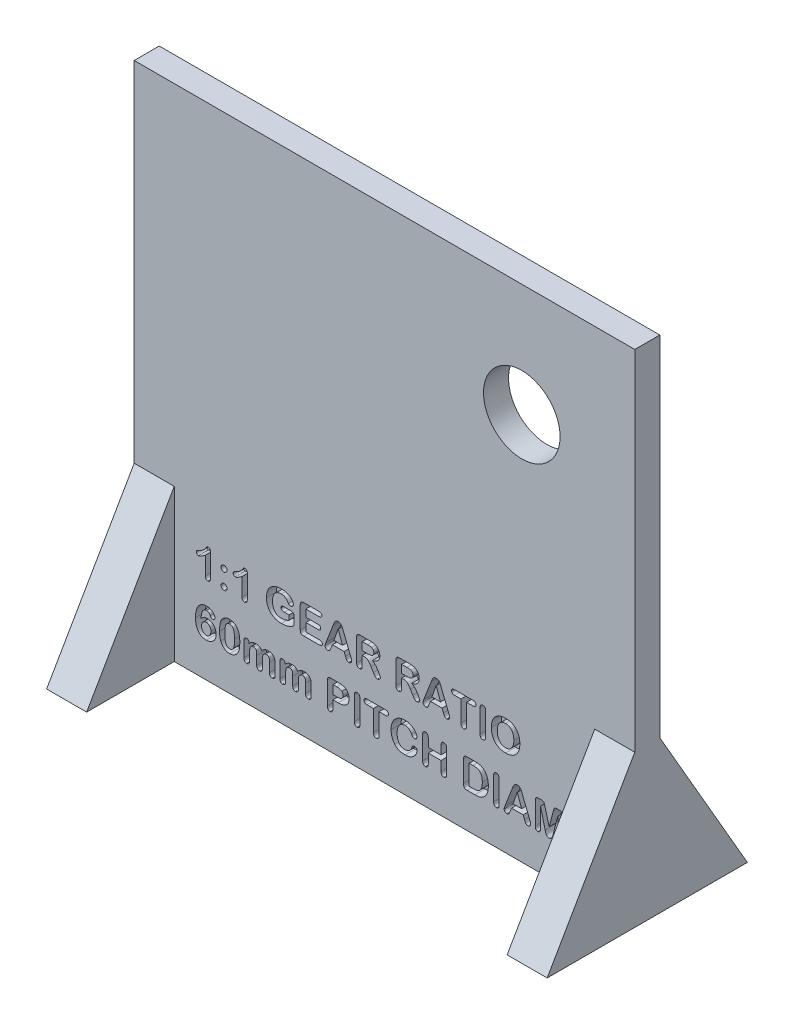
from build123d import *

# Parameters (mm, degrees)
SKETCH1_W           = 100
SKETCH1_H           = 100
SKETCH1_R           = 7.65
BOSS_EXTRUDE1_DEPTH = 5
BOSS_EXTRUDE3_DEPTH = 8
BOSS_EXTRUDE4_DEPTH = 8
SKETCH5_R           = 7.35
BOSS_EXTRUDE5_DEPTH = 15.5
CUT_EXTRUDE1_DEPTH  = 2


with BuildPart() as part:
    # Sketch1 → Boss-Extrude1 (new body)
    with BuildSketch(Plane.XY):
        with Locations((15, 15)):
            Rectangle(SKETCH1_W, SKETCH1_H)
        with Locations((42.426406871, 42.426406871)):
            Circle(SKETCH1_R, mode=Mode.SUBTRACT)
    extrude(amount=BOSS_EXTRUDE1_DEPTH)

    # Sketch3 → Boss-Extrude3 (add)
    with BuildSketch(Plane(origin=(65, 0, 0), x_dir=(0, 0, -1), z_dir=(1, 0, 0))):
        Polygon((-2.5, -0.358983849), (-22.5, -35), (17.5, -35), align=None)
    extrude(amount=-BOSS_EXTRUDE3_DEPTH)

    # Sketch4 → Boss-Extrude4 (add)
    with BuildSketch(Plane.ZY.offset(35)):
        Polygon((2.5, -35), (2.5, -0.358983849), (22.5, -35), align=None)
    extrude(amount=-BOSS_EXTRUDE4_DEPTH)

    # Sketch5 → Boss-Extrude5 (add)
    with BuildSketch(Plane(origin=(0, 0, 0), x_dir=(-1, 0, 0), z_dir=(0, 0, -1))):
        with Locations(Location((0, 0, 0), (0, 0, 180))):
            Circle(SKETCH5_R)
    extrude(amount=BOSS_EXTRUDE5_DEPTH)

    # Sketch6 → Cut-Extrude1 (cut)
    # profile 1 of 27: a face of its own
    with BuildSketch(Plane.XY.offset(5)):
        with BuildLine():
            Line((-20.804869871, -17.080445171), (-20.804869871, -13.515601421))
            add(Edge.make_bspline(
                [(-20.804869871, -13.515601421), (-20.884626436, -13.574640493), (-21.036149316, -13.686803927), (-21.256460997, -13.839370859), (-21.456466626, -13.968574178), (-21.635623825, -14.074610997), (-21.793953661, -14.158167378), (-21.932384753, -14.217340549), (-22.050834347, -14.256482407), (-22.124584933, -14.262804434), (-22.157213621, -14.265601421)],
                knots=[0, 0, 0, 0, 1.524937543, 2.897102299, 4.117716838, 5.183344192, 6.096256202, 6.865612508, 7.498124991, 8, 8, 8, 8], degree=3))
            add(Edge.make_bspline(
                [(-22.157213621, -14.265601421), (-22.184348746, -14.264047754), (-22.238209729, -14.260963854), (-22.316525549, -14.235157084), (-22.38850544, -14.191501627), (-22.454559325, -14.134742865), (-22.510517416, -14.066838572), (-22.550589696, -13.990500167), (-22.57694529, -13.909494835), (-22.579928565, -13.853302023), (-22.581432371, -13.824976421)],
                knots=[0, 0, 0, 0, 0.963758048, 1.912980161, 2.897257599, 3.941784678, 4.998716957, 6.005782735, 6.994757487, 8, 8, 8, 8], degree=3))
            add(Edge.make_bspline(
                [(-22.581432371, -13.824976421), (-22.579988772, -13.793166651), (-22.577269578, -13.73324909), (-22.553585874, -13.649617872), (-22.51336399, -13.579204571), (-22.452608786, -13.52244512), (-22.373118129, -13.470437512), (-22.273004819, -13.412776244), (-22.148426042, -13.348019072), (-22.056958741, -13.303996516), (-22.007213621, -13.280054546)],
                knots=[0, 0, 0, 0, 0.899430953, 1.694187344, 2.437953336, 3.16549883, 4.02470575, 5.125223224, 6.436532887, 8, 8, 8, 8], degree=3))
            add(Edge.make_bspline(
                [(-22.007213621, -13.280054546), (-21.930974322, -13.242652825), (-21.784643068, -13.170865167), (-21.580916163, -13.053320559), (-21.401020466, -12.932921909), (-21.242453174, -12.808160853), (-21.101246606, -12.677063671), (-20.971602736, -12.539524993), (-20.848724431, -12.396240825), (-20.755168541, -12.271645054), (-20.687222189, -12.172128618), (-20.63905815, -12.106361965), (-20.597030707, -12.046686949), (-20.55797019, -11.995988956), (-20.525789222, -11.951080523), (-20.497234392, -11.91468301), (-20.474227321, -11.885404207), (-20.448814617, -11.855987788), (-20.412520155, -11.82631973), (-20.35525257, -11.805318852), (-20.285105242, -11.79300287), (-20.233842175, -11.791445822), (-20.206041746, -11.790601421)],
                knots=[0, 0, 0, 0, 2.123034758, 4.074884479, 5.87647691, 7.531671309, 9.114587021, 10.689919895, 12.255836833, 13.832380571, 14.582986708, 15.268831144, 15.870649267, 16.407884949, 16.868947399, 17.251894771, 17.564620845, 17.799863546, 18.223953356, 18.719139771, 19.305377836, 20, 20, 20, 20], degree=3))
            add(Edge.make_bspline(
                [(-20.206041746, -11.790601421), (-20.173420614, -11.792698853), (-20.110279578, -11.796758615), (-20.019796304, -11.826472549), (-19.942591954, -11.880795137), (-19.874477368, -11.951827189), (-19.821740037, -12.042147677), (-19.78049666, -12.146951165), (-19.759790521, -12.268329295), (-19.756566327, -12.353821556), (-19.754869871, -12.398804546)],
                knots=[0, 0, 0, 0, 0.921243016, 1.783145896, 2.64927658, 3.562488144, 4.542770888, 5.583775906, 6.728668739, 8, 8, 8, 8], degree=3))
            Line((-19.754869871, -12.398804546), (-19.754869871, -16.921070171))
            add(Edge.make_bspline(
                [(-19.754869871, -16.921070171), (-19.756217997, -16.983278851), (-19.75874852, -17.100048691), (-19.782901176, -17.262703084), (-19.822406956, -17.401733359), (-19.881881184, -17.515407341), (-19.956193622, -17.607454649), (-20.050965249, -17.671196615), (-20.162327643, -17.708802432), (-20.241671511, -17.713258633), (-20.283385496, -17.715601421)],
                knots=[0, 0, 0, 0, 1.380618488, 2.591512956, 3.642588447, 4.573860471, 5.42354155, 6.241592279, 7.075540472, 8, 8, 8, 8], degree=3))
            add(Edge.make_bspline(
                [(-20.283385496, -17.715601421), (-20.321085854, -17.713582159), (-20.393428684, -17.709707416), (-20.496656135, -17.679673426), (-20.587365443, -17.628009134), (-20.666202114, -17.556596485), (-20.729041792, -17.464322664), (-20.773220512, -17.352753352), (-20.80016457, -17.222723679), (-20.803237419, -17.129807124), (-20.804869871, -17.080445171)],
                knots=[0, 0, 0, 0, 0.972556582, 1.866228868, 2.747000637, 3.646686402, 4.589551332, 5.602887627, 6.72653322, 8, 8, 8, 8], degree=3))
        make_face()
    # profile 2 of 27: a face of its own
    with BuildSketch(Plane.XY.offset(5)):
        with BuildLine():
            add(Edge.make_bspline(
                [(-17.049010496, -17.715601421), (-17.089033528, -17.713503099), (-17.167075, -17.709411553), (-17.280351078, -17.679216108), (-17.38400359, -17.627883899), (-17.478599843, -17.558993164), (-17.557782784, -17.471124695), (-17.6156318, -17.365001263), (-17.64838334, -17.24210925), (-17.65263965, -17.155252991), (-17.654869871, -17.109742046)],
                knots=[0, 0, 0, 0, 0.998960509, 1.947887116, 2.903410511, 3.873171148, 4.854298939, 5.832220262, 6.864126722, 8, 8, 8, 8], degree=3))
            add(Edge.make_bspline(
                [(-17.654869871, -17.109742046), (-17.653080722, -17.070407346), (-17.64956088, -16.993023146), (-17.61441471, -16.882327242), (-17.561613072, -16.779137732), (-17.485689181, -16.688751888), (-17.396091737, -16.611566574), (-17.29314544, -16.555357845), (-17.180099748, -16.520859826), (-17.101212569, -16.517384757), (-17.060729246, -16.515601421)],
                knots=[0, 0, 0, 0, 1.007642753, 1.982362345, 2.956461756, 3.969040175, 4.994467835, 5.978033734, 6.962367344, 8, 8, 8, 8], degree=3))
            add(Edge.make_bspline(
                [(-17.060729246, -16.515601421), (-17.020230334, -16.517376179), (-16.940937214, -16.52085099), (-16.827283683, -16.555870987), (-16.722049118, -16.609728864), (-16.630874634, -16.687149852), (-16.551755968, -16.776253789), (-16.496467242, -16.879639517), (-16.459696442, -16.991256169), (-16.456505238, -17.069595969), (-16.454869871, -17.109742046)],
                knots=[0, 0, 0, 0, 1.02791515, 2.012562649, 2.999766571, 4.016855155, 5.039129662, 6.013484395, 6.981988622, 8, 8, 8, 8], degree=3))
            add(Edge.make_bspline(
                [(-16.454869871, -17.109742046), (-16.456423534, -17.154556215), (-16.459404863, -17.240550272), (-16.495367248, -17.361428222), (-16.549958752, -17.469069503), (-16.630393114, -17.556113763), (-16.722413434, -17.626287496), (-16.823943424, -17.677910501), (-16.933849033, -17.709647111), (-17.01012725, -17.713591001), (-17.049010496, -17.715601421)],
                knots=[0, 0, 0, 0, 1.129257942, 2.166936788, 3.16083936, 4.153956704, 5.133579105, 6.074251673, 7.018339047, 8, 8, 8, 8], degree=3))
        make_face()
    # profile 3 of 27: a face of its own
    with BuildSketch(Plane.XY.offset(5)):
        with BuildLine():
            add(Edge.make_bspline(
                [(-17.654869871, -13.963257671), (-17.653313578, -13.918066517), (-17.65033956, -13.831707952), (-17.614937292, -13.710883229), (-17.559565121, -13.60537322), (-17.479979066, -13.519629584), (-17.386718735, -13.450670648), (-17.28202273, -13.40094972), (-17.168316894, -13.370280422), (-17.089441441, -13.367187056), (-17.049010496, -13.365601421)],
                knots=[0, 0, 0, 0, 1.130641307, 2.160612219, 3.12984056, 4.094448652, 5.068768473, 6.024521484, 6.987385031, 8, 8, 8, 8], degree=3))
            add(Edge.make_bspline(
                [(-17.049010496, -13.365601421), (-17.009709863, -13.367079946), (-16.932579029, -13.369981677), (-16.822043473, -13.402567762), (-16.71893918, -13.451614138), (-16.628344655, -13.522882402), (-16.549318662, -13.60868772), (-16.49353904, -13.713874802), (-16.459864013, -13.833856871), (-16.456582487, -13.918882916), (-16.454869871, -13.963257671)],
                knots=[0, 0, 0, 0, 0.995424578, 1.953605381, 2.903271147, 3.879722105, 4.863606292, 5.84478488, 6.875201808, 8, 8, 8, 8], degree=3))
            add(Edge.make_bspline(
                [(-16.454869871, -13.963257671), (-16.456985934, -14.000305375), (-16.461232809, -14.074659001), (-16.500868081, -14.182447711), (-16.561114308, -14.285968164), (-16.645063844, -14.378743232), (-16.739784059, -14.460028895), (-16.84237488, -14.521239746), (-16.950391583, -14.558740825), (-17.024123816, -14.563325362), (-17.060729246, -14.565601421)],
                knots=[0, 0, 0, 0, 0.948246233, 1.903101639, 2.914704438, 4.009338503, 5.098489341, 6.11009214, 7.061728004, 8, 8, 8, 8], degree=3))
            add(Edge.make_bspline(
                [(-17.060729246, -14.565601421), (-17.10005332, -14.563367852), (-17.177495467, -14.558969212), (-17.288917293, -14.523235848), (-17.391525864, -14.465696988), (-17.482742186, -14.387821606), (-17.558578278, -14.294784199), (-17.614693293, -14.191636475), (-17.649432958, -14.079904508), (-17.653037611, -14.002568086), (-17.654869871, -13.963257671)],
                knots=[0, 0, 0, 0, 1.005642606, 1.980443871, 2.965971593, 4.002503891, 5.033952151, 6.02343437, 6.995303741, 8, 8, 8, 8], degree=3))
        make_face()
    # profile 4 of 27: a face of its own
    with BuildSketch(Plane.XY.offset(5)):
        with BuildLine():
            Line((-13.454869871, -17.080445171), (-13.454869871, -13.515601421))
            add(Edge.make_bspline(
                [(-13.454869871, -13.515601421), (-13.534626436, -13.574640493), (-13.686149316, -13.686803927), (-13.906460997, -13.839370859), (-14.106466626, -13.968574178), (-14.285623825, -14.074610997), (-14.443953661, -14.158167378), (-14.582384753, -14.217340549), (-14.700834347, -14.256482407), (-14.774584933, -14.262804434), (-14.807213621, -14.265601421)],
                knots=[0, 0, 0, 0, 1.524937543, 2.897102299, 4.117716838, 5.183344192, 6.096256202, 6.865612508, 7.498124991, 8, 8, 8, 8], degree=3))
            add(Edge.make_bspline(
                [(-14.807213621, -14.265601421), (-14.834348746, -14.264047754), (-14.888209729, -14.260963854), (-14.966525549, -14.235157084), (-15.03850544, -14.191501627), (-15.104559325, -14.134742865), (-15.160517416, -14.066838572), (-15.200589696, -13.990500167), (-15.22694529, -13.909494835), (-15.229928565, -13.853302023), (-15.231432371, -13.824976421)],
                knots=[0, 0, 0, 0, 0.963758048, 1.912980161, 2.897257599, 3.941784678, 4.998716957, 6.005782735, 6.994757487, 8, 8, 8, 8], degree=3))
            add(Edge.make_bspline(
                [(-15.231432371, -13.824976421), (-15.229988772, -13.793166651), (-15.227269578, -13.73324909), (-15.203585874, -13.649617872), (-15.16336399, -13.579204571), (-15.102608786, -13.52244512), (-15.023118129, -13.470437512), (-14.923004819, -13.412776244), (-14.798426042, -13.348019072), (-14.706958741, -13.303996516), (-14.657213621, -13.280054546)],
                knots=[0, 0, 0, 0, 0.899430953, 1.694187344, 2.437953336, 3.16549883, 4.02470575, 5.125223224, 6.436532887, 8, 8, 8, 8], degree=3))
            add(Edge.make_bspline(
                [(-14.657213621, -13.280054546), (-14.580974322, -13.242652825), (-14.434643068, -13.170865167), (-14.230916163, -13.053320559), (-14.051020466, -12.932921909), (-13.892453174, -12.808160853), (-13.751246606, -12.677063671), (-13.621602736, -12.539524993), (-13.498724431, -12.396240825), (-13.405168541, -12.271645054), (-13.337222189, -12.172128618), (-13.28905815, -12.106361965), (-13.247030707, -12.046686949), (-13.20797019, -11.995988956), (-13.175789222, -11.951080523), (-13.147234392, -11.91468301), (-13.124227321, -11.885404207), (-13.098814617, -11.855987788), (-13.062520155, -11.82631973), (-13.00525257, -11.805318852), (-12.935105242, -11.79300287), (-12.883842175, -11.791445822), (-12.856041746, -11.790601421)],
                knots=[0, 0, 0, 0, 2.123034758, 4.074884479, 5.87647691, 7.531671309, 9.114587021, 10.689919895, 12.255836833, 13.832380571, 14.582986708, 15.268831144, 15.870649267, 16.407884949, 16.868947399, 17.251894771, 17.564620845, 17.799863546, 18.223953356, 18.719139771, 19.305377836, 20, 20, 20, 20], degree=3))
            add(Edge.make_bspline(
                [(-12.856041746, -11.790601421), (-12.823420614, -11.792698853), (-12.760279578, -11.796758615), (-12.669796304, -11.826472549), (-12.592591954, -11.880795137), (-12.524477368, -11.951827189), (-12.471740037, -12.042147677), (-12.43049666, -12.146951165), (-12.409790521, -12.268329295), (-12.406566327, -12.353821556), (-12.404869871, -12.398804546)],
                knots=[0, 0, 0, 0, 0.921243016, 1.783145896, 2.64927658, 3.562488144, 4.542770888, 5.583775906, 6.728668739, 8, 8, 8, 8], degree=3))
            Line((-12.404869871, -12.398804546), (-12.404869871, -16.921070171))
            add(Edge.make_bspline(
                [(-12.404869871, -16.921070171), (-12.406217997, -16.983278851), (-12.40874852, -17.100048691), (-12.432901176, -17.262703084), (-12.472406956, -17.401733359), (-12.531881184, -17.515407341), (-12.606193622, -17.607454649), (-12.700965249, -17.671196615), (-12.812327643, -17.708802432), (-12.891671511, -17.713258633), (-12.933385496, -17.715601421)],
                knots=[0, 0, 0, 0, 1.380618488, 2.591512956, 3.642588447, 4.573860471, 5.42354155, 6.241592279, 7.075540472, 8, 8, 8, 8], degree=3))
            add(Edge.make_bspline(
                [(-12.933385496, -17.715601421), (-12.971085854, -17.713582159), (-13.043428684, -17.709707416), (-13.146656135, -17.679673426), (-13.237365443, -17.628009134), (-13.316202114, -17.556596485), (-13.379041792, -17.464322664), (-13.423220512, -17.352753352), (-13.45016457, -17.222723679), (-13.453237419, -17.129807124), (-13.454869871, -17.080445171)],
                knots=[0, 0, 0, 0, 0.972556582, 1.866228868, 2.747000637, 3.646686402, 4.589551332, 5.602887627, 6.72653322, 8, 8, 8, 8], degree=3))
        make_face()
    # profile 5 of 27: a face of its own
    with BuildSketch(Plane.XY.offset(5)):
        with BuildLine():
            Line((-3.029869871, -15.267554546), (-3.029869871, -16.377320171))
            add(Edge.make_bspline(
                [(-3.029869871, -16.377320171), (-3.030130201, -16.412499887), (-3.030622763, -16.479062193), (-3.039277498, -16.573343241), (-3.051218571, -16.65663474), (-3.070116579, -16.730290358), (-3.096586517, -16.796393183), (-3.130985222, -16.858691691), (-3.175903338, -16.916810177), (-3.249149448, -16.992518631), (-3.362520736, -17.082784382), (-3.464946133, -17.14311037), (-3.519713621, -17.175367046)],
                knots=[0, 0, 0, 0, 1.05167989, 1.989846651, 2.829196185, 3.565931773, 4.257962754, 4.953534565, 5.687207176, 6.447374645, 8.100389424, 10, 10, 10, 10], degree=3))
            add(Edge.make_bspline(
                [(-3.519713621, -17.175367046), (-3.606329654, -17.220141625), (-3.776260064, -17.30798405), (-4.034180387, -17.41961243), (-4.286406625, -17.51462658), (-4.53698314, -17.589489397), (-4.790316407, -17.646395656), (-5.052323362, -17.685719592), (-5.324680571, -17.711119875), (-5.510280916, -17.714092643), (-5.604479246, -17.715601421)],
                knots=[0, 0, 0, 0, 1.07439078, 2.1078276, 3.0954898, 4.043555579, 4.987801064, 5.954741935, 6.961963702, 8, 8, 8, 8], degree=3))
            add(Edge.make_bspline(
                [(-5.604479246, -17.715601421), (-5.713980411, -17.713259167), (-5.929000004, -17.70865985), (-6.243726058, -17.668561036), (-6.544286708, -17.606581949), (-6.828285017, -17.515846264), (-7.095135021, -17.40137189), (-7.342340354, -17.262304104), (-7.570299237, -17.1015188), (-7.776184026, -16.916172896), (-7.961063571, -16.709479948), (-8.122310031, -16.480220316), (-8.260695348, -16.230511984), (-8.376907028, -15.961420238), (-8.468634576, -15.673792459), (-8.531689087, -15.368548674), (-8.573327979, -15.047607457), (-8.577658177, -14.827846587), (-8.579869871, -14.715601421)],
                knots=[0, 0, 0, 0, 1.100386502, 2.160750142, 3.184321939, 4.181582475, 5.152517567, 6.098441418, 7.027870255, 7.951106382, 8.87726923, 9.809903018, 10.762681596, 11.742383864, 12.752061269, 13.791813684, 14.872145711, 16, 16, 16, 16], degree=3))
            add(Edge.make_bspline(
                [(-8.579869871, -14.715601421), (-8.577398104, -14.604947202), (-8.5725534, -14.388063162), (-8.534385699, -14.07001643), (-8.471458335, -13.766347432), (-8.382595384, -13.477835765), (-8.269273495, -13.206720206), (-8.13209217, -12.955583446), (-7.970261985, -12.72657234), (-7.785560644, -12.518844445), (-7.576740564, -12.334635175), (-7.346993665, -12.171511886), (-7.094898215, -12.033524363), (-6.82241806, -11.918259351), (-6.530449378, -11.827140927), (-6.219008707, -11.761510477), (-5.888673946, -11.722634549), (-5.662007141, -11.717983935), (-5.545885496, -11.715601421)],
                knots=[0, 0, 0, 0, 1.098578105, 2.153230663, 3.175691274, 4.174419311, 5.14625478, 6.088916885, 7.010162605, 7.925016398, 8.842768463, 9.769420772, 10.717351455, 11.690695295, 12.702839522, 13.749673472, 14.847155329, 16, 16, 16, 16], degree=3))
            add(Edge.make_bspline(
                [(-5.545885496, -11.715601421), (-5.450884532, -11.717212917), (-5.265872753, -11.720351262), (-4.996580413, -11.750129346), (-4.744044829, -11.798783016), (-4.509342456, -11.866718965), (-4.294656209, -11.950347792), (-4.098488673, -12.042044411), (-3.924485233, -12.146129261), (-3.772811443, -12.260961962), (-3.639439001, -12.380587678), (-3.524854448, -12.505440908), (-3.42443974, -12.631683737), (-3.345825049, -12.762631255), (-3.28464244, -12.8907517), (-3.236590434, -13.011750499), (-3.210139779, -13.127357283), (-3.20551174, -13.202212814), (-3.203307371, -13.237867046)],
                knots=[0, 0, 0, 0, 1.493654161, 2.908850607, 4.254647133, 5.533949551, 6.745570033, 7.874969631, 8.935929066, 9.927474038, 10.862663671, 11.749528455, 12.590074434, 13.395023508, 14.145147076, 14.821757919, 15.438794752, 16, 16, 16, 16], degree=3))
            add(Edge.make_bspline(
                [(-3.203307371, -13.237867046), (-3.205434367, -13.273609337), (-3.209599908, -13.343607591), (-3.239663123, -13.444721645), (-3.291593124, -13.536500478), (-3.361693419, -13.617585932), (-3.445387239, -13.68536741), (-3.539099651, -13.735413851), (-3.641609723, -13.766445636), (-3.712851569, -13.769502099), (-3.749401121, -13.771070171)],
                knots=[0, 0, 0, 0, 1.011347772, 1.98063909, 2.956031586, 3.97569046, 4.998224318, 5.987747808, 6.967644449, 8, 8, 8, 8], degree=3))
            add(Edge.make_bspline(
                [(-3.749401121, -13.771070171), (-3.790429094, -13.76800149), (-3.87333343, -13.761800672), (-3.99123311, -13.715203193), (-4.09758441, -13.642535054), (-4.152016284, -13.576082434), (-4.179479246, -13.542554546)],
                knots=[0, 0, 0, 0, 0.973372159, 1.966872028, 2.974209188, 4, 4, 4, 4], degree=3))
            add(Edge.make_bspline(
                [(-4.179479246, -13.542554546), (-4.214250243, -13.488779176), (-4.279623868, -13.387675061), (-4.377571152, -13.248987898), (-4.465931978, -13.130334173), (-4.549139278, -13.029447417), (-4.633251475, -12.940264549), (-4.731254649, -12.864810371), (-4.840065285, -12.793955804), (-4.96327852, -12.731745277), (-5.101019577, -12.67762593), (-5.257594328, -12.641181106), (-5.431561104, -12.618888019), (-5.553623374, -12.616728973), (-5.617369871, -12.615601421)],
                knots=[0, 0, 0, 0, 1.270284042, 2.388285663, 3.367826865, 4.204273144, 4.982473651, 5.793364349, 6.651044596, 7.555617024, 8.527062579, 9.579629544, 10.735971918, 12, 12, 12, 12], degree=3))
            add(Edge.make_bspline(
                [(-5.617369871, -12.615601421), (-5.684241128, -12.617545292), (-5.814975757, -12.621345598), (-6.005661787, -12.646808469), (-6.185134516, -12.691665575), (-6.353368043, -12.753762191), (-6.509952686, -12.83280838), (-6.655445548, -12.926921274), (-6.788635866, -13.038008512), (-6.909716319, -13.165028369), (-7.017471563, -13.307731934), (-7.113617208, -13.46461905), (-7.19370471, -13.638104798), (-7.261708659, -13.824968239), (-7.313786681, -14.025216146), (-7.352747698, -14.235820538), (-7.374785467, -14.457712877), (-7.378148524, -14.60891385), (-7.379869871, -14.686304546)],
                knots=[0, 0, 0, 0, 1.044628969, 2.042270301, 2.998361366, 3.928992089, 4.837758762, 5.733129983, 6.630080197, 7.540791152, 8.468355801, 9.418625922, 10.40956343, 11.448096838, 12.521211322, 13.637926174, 14.790996301, 16, 16, 16, 16], degree=3))
            add(Edge.make_bspline(
                [(-7.379869871, -14.686304546), (-7.378671533, -14.769167053), (-7.376338052, -14.930522267), (-7.353917364, -15.165171046), (-7.316552458, -15.384876027), (-7.265517429, -15.590205566), (-7.198358911, -15.780675158), (-7.117993392, -15.957531108), (-7.02147207, -16.119222436), (-6.909905162, -16.26486611), (-6.785070504, -16.394364231), (-6.64865496, -16.507761486), (-6.499897752, -16.60339618), (-6.339093556, -16.680836922), (-6.167468201, -16.742011222), (-5.983984692, -16.785280984), (-5.788834978, -16.811441999), (-5.654562844, -16.814191771), (-5.585729246, -16.815601421)],
                knots=[0, 0, 0, 0, 1.258141377, 2.449933962, 3.575390538, 4.640093752, 5.658870901, 6.638339712, 7.585514639, 8.512181286, 9.418399795, 10.311632542, 11.200223959, 12.096995521, 13.016399166, 13.961733165, 14.955097869, 16, 16, 16, 16], degree=3))
            add(Edge.make_bspline(
                [(-5.585729246, -16.815601421), (-5.518097667, -16.814224215), (-5.384882153, -16.811511499), (-5.188357116, -16.790816438), (-4.997779356, -16.758764779), (-4.812607936, -16.710644115), (-4.629652967, -16.651494421), (-4.44664575, -16.580907255), (-4.262555344, -16.498857187), (-4.141315911, -16.436864191), (-4.079869871, -16.405445171)],
                knots=[0, 0, 0, 0, 1.028897666, 2.026643961, 3.003818171, 3.966807385, 4.934846124, 5.928298728, 6.95002941, 8, 8, 8, 8], degree=3))
            Line((-4.079869871, -16.405445171), (-4.079869871, -15.465601421))
            Line((-4.079869871, -15.465601421), (-4.998619871, -15.465601421))
            add(Edge.make_bspline(
                [(-4.998619871, -15.465601421), (-5.050673627, -15.464958311), (-5.148193275, -15.463753483), (-5.284250832, -15.442598098), (-5.40153691, -15.414387298), (-5.499516964, -15.37013411), (-5.576781391, -15.308521052), (-5.633457959, -15.229165464), (-5.664987208, -15.130312641), (-5.668330888, -15.059184433), (-5.670104246, -15.021460796)],
                knots=[0, 0, 0, 0, 1.358690867, 2.545427349, 3.590341975, 4.503704112, 5.331160324, 6.144067978, 7.015685797, 8, 8, 8, 8], degree=3))
            add(Edge.make_bspline(
                [(-5.670104246, -15.021460796), (-5.668889152, -14.98958427), (-5.66653017, -14.9276992), (-5.637626744, -14.840094201), (-5.593634402, -14.760837536), (-5.532265083, -14.691442729), (-5.455160367, -14.634902705), (-5.364514585, -14.593071172), (-5.260667947, -14.570207038), (-5.187790186, -14.567179814), (-5.149791746, -14.565601421)],
                knots=[0, 0, 0, 0, 0.980805911, 1.904136086, 2.816924439, 3.765675331, 4.740453241, 5.749851111, 6.826773133, 8, 8, 8, 8], degree=3))
            Line((-5.149791746, -14.565601421), (-3.822057371, -14.565601421))
            add(Edge.make_bspline(
                [(-3.822057371, -14.565601421), (-3.782981514, -14.565942786), (-3.707469599, -14.566602455), (-3.599022686, -14.574643215), (-3.499953535, -14.588659224), (-3.409608949, -14.607829421), (-3.327046539, -14.636712806), (-3.252796255, -14.679633462), (-3.187530155, -14.737205979), (-3.130487034, -14.808501676), (-3.083508125, -14.896569318), (-3.051689709, -15.003567788), (-3.0338418, -15.129456051), (-3.03125357, -15.219445248), (-3.029869871, -15.267554546)],
                knots=[0, 0, 0, 0, 1.134119292, 2.191622269, 3.153761991, 4.036816067, 4.868972684, 5.681903256, 6.509644808, 7.380899382, 8.319362442, 9.38811255, 10.603653811, 12, 12, 12, 12], degree=3))
        make_face()
    # profile 6 of 27: a face of its own
    with BuildSketch(Plane.XY.offset(5)):
        with BuildLine():
            Line((1.941223879, -12.765601421), (-0.704869871, -12.765601421))
            Line((-0.704869871, -12.765601421), (-0.704869871, -14.190601421))
            Line((-0.704869871, -14.190601421), (1.731458254, -14.190601421))
            add(Edge.make_bspline(
                [(1.731458254, -14.190601421), (1.773736341, -14.192201466), (1.853094764, -14.195204844), (1.964181522, -14.216448933), (2.058129931, -14.25544142), (2.134560898, -14.309854134), (2.193260227, -14.377530453), (2.236410029, -14.454681258), (2.261636251, -14.542977397), (2.264397395, -14.604889869), (2.265833254, -14.637085796)],
                knots=[0, 0, 0, 0, 1.285293232, 2.412569968, 3.418386025, 4.354403319, 5.23810445, 6.120527863, 7.022630715, 8, 8, 8, 8], degree=3))
            add(Edge.make_bspline(
                [(2.265833254, -14.637085796), (2.264437735, -14.669301451), (2.261754165, -14.731251859), (2.235939685, -14.819434559), (2.194382717, -14.89820639), (2.136245136, -14.967306111), (2.06044701, -15.023725379), (1.966260421, -15.063689935), (1.854391201, -15.086310121), (1.774145135, -15.089111322), (1.731458254, -15.090601421)],
                knots=[0, 0, 0, 0, 0.971200242, 1.867609123, 2.749214551, 3.645234956, 4.57279535, 5.576919765, 6.711042891, 8, 8, 8, 8], degree=3))
            Line((1.731458254, -15.090601421), (-0.704869871, -15.090601421))
            Line((-0.704869871, -15.090601421), (-0.704869871, -16.740601421))
            Line((-0.704869871, -16.740601421), (2.032630129, -16.740601421))
            add(Edge.make_bspline(
                [(2.032630129, -16.740601421), (2.076070921, -16.742226886), (2.157734965, -16.745282585), (2.272841116, -16.76638377), (2.370386034, -16.806466646), (2.450934625, -16.861339814), (2.514589573, -16.928689726), (2.558374101, -17.008775762), (2.586815059, -17.098072568), (2.589209519, -17.161468915), (2.590442629, -17.194117046)],
                knots=[0, 0, 0, 0, 1.281412047, 2.408917619, 3.431661904, 4.368016538, 5.264760761, 6.136510243, 7.040331808, 8, 8, 8, 8], degree=3))
            add(Edge.make_bspline(
                [(2.590442629, -17.194117046), (2.589273863, -17.226009168), (2.587018525, -17.287550615), (2.557860896, -17.374282142), (2.514273067, -17.452720204), (2.45092183, -17.519778463), (2.370657331, -17.575069281), (2.272386649, -17.612943244), (2.157952059, -17.636481491), (2.076119277, -17.639171725), (2.032630129, -17.640601421)],
                knots=[0, 0, 0, 0, 0.944744106, 1.823049547, 2.692159438, 3.596595969, 4.540982691, 5.5681055, 6.707595947, 8, 8, 8, 8], degree=3))
            Line((2.032630129, -17.640601421), (-1.140807371, -17.640601421))
            add(Edge.make_bspline(
                [(-1.140807371, -17.640601421), (-1.198013593, -17.638936641), (-1.304468091, -17.635838669), (-1.451960214, -17.604368878), (-1.574897801, -17.552316676), (-1.674264656, -17.475740153), (-1.746100696, -17.371755673), (-1.796254179, -17.2444265), (-1.824224829, -17.091789618), (-1.827901514, -16.982124447), (-1.829869871, -16.923413921)],
                knots=[0, 0, 0, 0, 1.189456171, 2.21344733, 3.119993849, 3.948013107, 4.78741338, 5.71757596, 6.778077714, 8, 8, 8, 8], degree=3))
            Line((-1.829869871, -16.923413921), (-1.829869871, -12.582788921))
            add(Edge.make_bspline(
                [(-1.829869871, -12.582788921), (-1.828968925, -12.542517403), (-1.827258128, -12.466046293), (-1.814533786, -12.356885605), (-1.792883625, -12.25915451), (-1.761032809, -12.172402167), (-1.720369464, -12.096042229), (-1.667634762, -12.03141601), (-1.604610426, -11.978295583), (-1.531821398, -11.93519749), (-1.448208688, -11.904382505), (-1.355273871, -11.880407814), (-1.251269974, -11.868442855), (-1.178721424, -11.866576686), (-1.140807371, -11.865601421)],
                knots=[0, 0, 0, 0, 1.257097402, 2.387087425, 3.425508426, 4.374733264, 5.264346199, 6.113849079, 6.961774747, 7.825601221, 8.740599092, 9.73444991, 10.816017894, 12, 12, 12, 12], degree=3))
            Line((-1.140807371, -11.865601421), (1.941223879, -11.865601421))
            add(Edge.make_bspline(
                [(1.941223879, -11.865601421), (1.985040478, -11.867261379), (2.067451214, -11.870383446), (2.183161346, -11.890952729), (2.280077106, -11.931595434), (2.359842216, -11.9858816), (2.419831361, -12.054207751), (2.465402507, -12.13123894), (2.491303579, -12.219455351), (2.49409099, -12.281455531), (2.495520754, -12.313257671)],
                knots=[0, 0, 0, 0, 1.304353081, 2.453241492, 3.474309848, 4.409392115, 5.298405909, 6.157667996, 7.055001114, 8, 8, 8, 8], degree=3))
            add(Edge.make_bspline(
                [(2.495520754, -12.313257671), (2.49414683, -12.345857743), (2.491483676, -12.409048308), (2.465051546, -12.498902459), (2.420607239, -12.577857287), (2.359718551, -12.646358812), (2.280368103, -12.70104665), (2.182835627, -12.739863949), (2.067505299, -12.760944882), (1.985059252, -12.763985022), (1.941223879, -12.765601421)],
                knots=[0, 0, 0, 0, 0.962139494, 1.864969442, 2.738963821, 3.622448103, 4.551714319, 5.562017248, 6.70375977, 8, 8, 8, 8], degree=3))
        make_face()
    # profile 7 of 27: a face of its own
    with BuildSketch(Plane.XY.offset(5)):
        with BuildLine():
            Line((7.204114504, -16.990210796), (6.929895754, -16.290601421))
            Line((6.929895754, -16.290601421), (4.596692629, -16.290601421))
            Line((4.596692629, -16.290601421), (4.322473879, -17.005445171))
            add(Edge.make_bspline(
                [(4.322473879, -17.005445171), (4.297294167, -17.069753676), (4.251143826, -17.187620766), (4.179612878, -17.345701554), (4.114775267, -17.470276353), (4.054651559, -17.567025872), (3.98452225, -17.638357914), (3.896584782, -17.684057936), (3.791632247, -17.710973225), (3.716013766, -17.713989402), (3.675598879, -17.715601421)],
                knots=[0, 0, 0, 0, 1.589179946, 2.912709847, 3.990397165, 4.820646782, 5.526248733, 6.26234321, 7.071295771, 8, 8, 8, 8], degree=3))
            add(Edge.make_bspline(
                [(3.675598879, -17.715601421), (3.63981782, -17.713585019), (3.569255996, -17.709608586), (3.467263961, -17.677328705), (3.372049208, -17.625850776), (3.285669621, -17.55626897), (3.212719383, -17.474101676), (3.159855632, -17.382749995), (3.125952542, -17.285911169), (3.122079109, -17.218607142), (3.120130129, -17.184742046)],
                knots=[0, 0, 0, 0, 1.012468346, 1.996632184, 3.002236258, 4.065667855, 5.124941345, 6.097262832, 7.042607408, 8, 8, 8, 8], degree=3))
            add(Edge.make_bspline(
                [(3.120130129, -17.184742046), (3.12193644, -17.14434271), (3.125646938, -17.061354944), (3.152040425, -16.956707012), (3.183728961, -16.866230653), (3.213007878, -16.78417473), (3.247784581, -16.689340317), (3.274623911, -16.622558317), (3.288880129, -16.587085796)],
                knots=[0, 0, 0, 0, 1.162779838, 2.388566498, 3.08974091, 3.926345762, 4.898539362, 6, 6, 6, 6], degree=3))
            Line((3.288880129, -16.587085796), (4.757239504, -12.819507671))
            add(Edge.make_bspline(
                [(4.757239504, -12.819507671), (4.768096946, -12.790960994), (4.790739315, -12.731429073), (4.827943659, -12.638560233), (4.865707521, -12.536884619), (4.907242254, -12.430148983), (4.949507202, -12.323248648), (4.99709368, -12.224212524), (5.04300983, -12.133290842), (5.092859923, -12.052331198), (5.147167149, -11.979229018), (5.209401289, -11.914662678), (5.279931429, -11.858006447), (5.357148864, -11.806791574), (5.44418359, -11.765709489), (5.54081531, -11.736256171), (5.646831542, -11.718667136), (5.720841853, -11.716647802), (5.759192629, -11.715601421)],
                knots=[0, 0, 0, 0, 0.906149852, 1.889706515, 2.96811083, 4.12389095, 5.288239382, 6.376994434, 7.382631969, 8.308939681, 9.194397083, 10.07962691, 10.961131357, 11.874074475, 12.822804478, 13.805267996, 14.862730428, 16, 16, 16, 16], degree=3))
            add(Edge.make_bspline(
                [(5.759192629, -11.715601421), (5.797938702, -11.716637169), (5.872734505, -11.718636587), (5.979837576, -11.736382075), (6.077198993, -11.765099726), (6.163464618, -11.807302182), (6.241236901, -11.857027444), (6.312007452, -11.912772176), (6.373566168, -11.977204544), (6.444877685, -12.071705847), (6.52159734, -12.199774764), (6.585783127, -12.337988246), (6.632323842, -12.459629382), (6.675855047, -12.563866597), (6.720628501, -12.683532693), (6.752527115, -12.767955811), (6.769348879, -12.812476421)],
                knots=[0, 0, 0, 0, 1.005463131, 1.940955953, 2.810500616, 3.631666672, 4.42517864, 5.204561669, 5.964968357, 6.731842121, 8.274852444, 9.831306624, 10.68267648, 11.656482744, 12.764143998, 14, 14, 14, 14], degree=3))
            Line((6.769348879, -12.812476421), (8.269348879, -16.555445171))
            add(Edge.make_bspline(
                [(8.269348879, -16.555445171), (8.28306094, -16.589799731), (8.309465663, -16.655954818), (8.346811103, -16.751459642), (8.374654624, -16.841036983), (8.402350567, -16.921791788), (8.420033406, -16.996619081), (8.434712102, -17.06324406), (8.443783713, -17.12276936), (8.444698702, -17.160106105), (8.445130129, -17.177710796)],
                knots=[0, 0, 0, 0, 1.36622511, 2.630880465, 3.785062113, 4.829837655, 5.781525877, 6.621841003, 7.350182692, 8, 8, 8, 8], degree=3))
            add(Edge.make_bspline(
                [(8.445130129, -17.177710796), (8.442974986, -17.210733605), (8.438649656, -17.277009769), (8.406961665, -17.374269527), (8.351946471, -17.465286581), (8.280666058, -17.550630498), (8.19489718, -17.62381394), (8.096738599, -17.676997802), (7.990172761, -17.709778083), (7.915673313, -17.713643671), (7.877942629, -17.715601421)],
                knots=[0, 0, 0, 0, 0.918533131, 1.843478885, 2.81316186, 3.862812883, 4.927781559, 5.930017069, 6.951644948, 8, 8, 8, 8], degree=3))
            add(Edge.make_bspline(
                [(7.877942629, -17.715601421), (7.835084312, -17.713718237), (7.754336461, -17.710170195), (7.642676884, -17.674141367), (7.551173345, -17.615275255), (7.486491099, -17.552323969), (7.44199215, -17.489543383), (7.406981657, -17.431874102), (7.370806365, -17.363701867), (7.322632535, -17.261725531), (7.268408899, -17.13541948), (7.22450759, -17.036268516), (7.204114504, -16.990210796)],
                knots=[0, 0, 0, 0, 1.202315025, 2.265239587, 3.252603888, 4.239051274, 4.781746036, 5.412840692, 6.135219166, 6.950797606, 8.583580985, 10, 10, 10, 10], degree=3))
        make_face()
        Polygon((4.901380129, -15.390601421), (6.617005129, -15.390601421), (5.750989504, -12.990601421), align=None, mode=Mode.SUBTRACT)
    # profile 8 of 27: a face of its own
    with BuildSketch(Plane.XY.offset(5)):
        with BuildLine():
            Line((10.950598879, -15.165601421), (10.545130129, -15.165601421))
            Line((10.545130129, -15.165601421), (10.545130129, -17.007788921))
            add(Edge.make_bspline(
                [(10.545130129, -17.007788921), (10.543702573, -17.064573885), (10.541031536, -17.170821676), (10.512071516, -17.318785464), (10.463335, -17.443577932), (10.394466147, -17.544534041), (10.309120653, -17.621017445), (10.211752048, -17.676391965), (10.102013094, -17.710291869), (10.024669908, -17.713800588), (9.984973879, -17.715601421)],
                knots=[0, 0, 0, 0, 1.331902197, 2.492062242, 3.520752585, 4.456973203, 5.333663409, 6.188000262, 7.069999586, 8, 8, 8, 8], degree=3))
            add(Edge.make_bspline(
                [(9.984973879, -17.715601421), (9.942549554, -17.713448482), (9.860899442, -17.709304923), (9.745913955, -17.674923667), (9.646608704, -17.616719892), (9.562751368, -17.536619825), (9.497678199, -17.433088132), (9.452860599, -17.308394049), (9.424537117, -17.163735292), (9.42165679, -17.060279759), (9.420130129, -17.005445171)],
                knots=[0, 0, 0, 0, 0.98783513, 1.901193439, 2.76656523, 3.649069121, 4.578809423, 5.590416226, 6.722847106, 8, 8, 8, 8], degree=3))
            Line((9.420130129, -17.005445171), (9.420130129, -12.579273296))
            add(Edge.make_bspline(
                [(9.420130129, -12.579273296), (9.421847562, -12.520900639), (9.425070096, -12.411372115), (9.456315452, -12.259842428), (9.507121772, -12.13259848), (9.582263127, -12.03023788), (9.683401804, -11.953840557), (9.809029796, -11.901669821), (9.959254165, -11.870508118), (10.067620319, -11.867311624), (10.125598879, -11.865601421)],
                knots=[0, 0, 0, 0, 1.204539147, 2.260157444, 3.178834964, 4.014831347, 4.849268471, 5.763683293, 6.803515522, 8, 8, 8, 8], degree=3))
            Line((10.125598879, -11.865601421), (11.995911379, -11.865601421))
            add(Edge.make_bspline(
                [(11.995911379, -11.865601421), (12.058021909, -11.866170455), (12.177584043, -11.867265839), (12.350392819, -11.872259386), (12.50901123, -11.884451461), (12.655296149, -11.899367951), (12.79117151, -11.919350914), (12.918550992, -11.950837368), (13.039914079, -11.988249625), (13.116126238, -12.022260421), (13.153723879, -12.039038921)],
                knots=[0, 0, 0, 0, 1.26312999, 2.431512321, 3.514756431, 4.497259456, 5.421894158, 6.30431173, 7.16346842, 8, 8, 8, 8], degree=3))
            add(Edge.make_bspline(
                [(13.153723879, -12.039038921), (13.198712634, -12.05923354), (13.288168301, -12.099388532), (13.414342684, -12.175697258), (13.532831651, -12.263199239), (13.641704297, -12.363559461), (13.741804187, -12.472592717), (13.827116108, -12.593521259), (13.901617033, -12.721438203), (13.962506726, -12.857883485), (14.009943761, -13.000521883), (14.04606623, -13.14769238), (14.065727856, -13.299440068), (14.068655185, -13.401878251), (14.070130129, -13.453492046)],
                knots=[0, 0, 0, 0, 0.991101386, 1.970706541, 2.959125982, 3.949043219, 4.94477413, 5.930285116, 6.919453739, 7.918248778, 8.929482208, 9.939493973, 10.961807665, 12, 12, 12, 12], degree=3))
            add(Edge.make_bspline(
                [(14.070130129, -13.453492046), (14.069086847, -13.505890897), (14.067048603, -13.608261761), (14.048773244, -13.757527298), (14.020941018, -13.899140909), (13.981911751, -14.033150124), (13.927894765, -14.158064494), (13.865224423, -14.275501571), (13.79034737, -14.384882042), (13.70341208, -14.485794375), (13.604118411, -14.578382262), (13.49401054, -14.664703488), (13.372334967, -14.74437699), (13.23780711, -14.815544513), (13.09183911, -14.88044059), (12.933524202, -14.936615887), (12.7643402, -14.989646986), (12.646139591, -15.016075301), (12.585364504, -15.029663921)],
                knots=[0, 0, 0, 0, 1.055142993, 2.061417327, 3.024364171, 3.960444909, 4.866579139, 5.760848635, 6.638237999, 7.530982974, 8.438346324, 9.368654669, 10.346405169, 11.363786046, 12.431180916, 13.561267985, 14.746079633, 16, 16, 16, 16], degree=3))
            add(Edge.make_bspline(
                [(12.585364504, -15.029663921), (12.638052849, -15.058978616), (12.745487101, -15.118752791), (12.896675647, -15.2328691), (13.046073921, -15.363625833), (13.187841134, -15.51514832), (13.325584215, -15.676699024), (13.458620805, -15.844137653), (13.582694326, -16.017589762), (13.697044942, -16.194379278), (13.80282621, -16.368135329), (13.896958745, -16.535666136), (13.977658016, -16.695091463), (14.046232202, -16.843151572), (14.10085534, -16.975296616), (14.139771279, -17.08714153), (14.165916589, -17.17580698), (14.171091971, -17.228389212), (14.173255129, -17.250367046)],
                knots=[0, 0, 0, 0, 1.03513849, 2.110700756, 3.247524223, 4.444168505, 5.672631725, 6.896242247, 8.11841533, 9.33624741, 10.514118669, 11.614189172, 12.638032039, 13.584270828, 14.418327787, 15.09350525, 15.621111712, 16, 16, 16, 16], degree=3))
            add(Edge.make_bspline(
                [(14.173255129, -17.250367046), (14.169255424, -17.288456229), (14.160862982, -17.36837744), (14.112221584, -17.460440416), (14.060758, -17.528748391), (14.014523571, -17.5768736), (13.960173958, -17.617287694), (13.900307958, -17.652807448), (13.834582704, -17.68104896), (13.763177601, -17.700573592), (13.687065608, -17.714357604), (13.63425779, -17.715180433), (13.607239504, -17.715601421)],
                knots=[0, 0, 0, 0, 1.406975553, 2.952207972, 3.767564478, 4.575194754, 5.410805362, 6.266190622, 7.146975177, 8.048514508, 9.001553276, 10, 10, 10, 10], degree=3))
            add(Edge.make_bspline(
                [(13.607239504, -17.715601421), (13.575493973, -17.714614633), (13.514212744, -17.712709747), (13.426436034, -17.694152536), (13.345620704, -17.666866734), (13.249862477, -17.612082195), (13.144287866, -17.522423725), (13.054834024, -17.411839053), (12.985841111, -17.307319883), (12.925712822, -17.211233042), (12.854479213, -17.099938621), (12.805861491, -17.019245078), (12.779895754, -16.976148296)],
                knots=[0, 0, 0, 0, 0.811939239, 1.567358733, 2.288822191, 2.987519458, 4.379962622, 5.808282274, 6.615771143, 7.58722562, 8.711386222, 10, 10, 10, 10], degree=3))
            Line((12.779895754, -16.976148296), (12.308802004, -16.201538921))
            add(Edge.make_bspline(
                [(12.308802004, -16.201538921), (12.268635951, -16.134461193), (12.192679407, -16.007612973), (12.078161087, -15.832274936), (11.969094306, -15.683103579), (11.866579563, -15.556781909), (11.766962316, -15.451411361), (11.66757105, -15.36466079), (11.565801762, -15.297521607), (11.46232645, -15.244798761), (11.351141524, -15.208344072), (11.229339667, -15.182850063), (11.094338386, -15.167755092), (10.999857649, -15.166339473), (10.950598879, -15.165601421)],
                knots=[0, 0, 0, 0, 1.54923933, 2.929709427, 4.148172657, 5.209662816, 6.151357592, 7.018659628, 7.817301611, 8.561575462, 9.313059885, 10.128334294, 11.024182546, 12, 12, 12, 12], degree=3))
        make_face()
        with BuildLine():
            Line((11.613880129, -12.765601421), (10.545130129, -12.765601421))
            Line((10.545130129, -12.765601421), (10.545130129, -14.340601421))
            Line((10.545130129, -14.340601421), (11.582239504, -14.340601421))
            add(Edge.make_bspline(
                [(11.582239504, -14.340601421), (11.649054914, -14.339643754), (11.777738712, -14.337799325), (11.96208985, -14.325495163), (12.13009519, -14.30337987), (12.281205641, -14.272473938), (12.417149559, -14.231531862), (12.53466912, -14.174307198), (12.63812753, -14.108082647), (12.722749437, -14.025544298), (12.790785515, -13.928353859), (12.836856162, -13.813759642), (12.865556295, -13.683805337), (12.868555927, -13.59193818), (12.870130129, -13.543726421)],
                knots=[0, 0, 0, 0, 1.392051732, 2.681035748, 3.846991481, 4.919597892, 5.892539963, 6.795281946, 7.634960986, 8.440706374, 9.24212453, 10.088520951, 10.996858383, 12, 12, 12, 12], degree=3))
            add(Edge.make_bspline(
                [(12.870130129, -13.543726421), (12.869058804, -13.504917142), (12.866959958, -13.42888545), (12.842299902, -13.319277573), (12.804643717, -13.216431408), (12.751644482, -13.121893505), (12.686159541, -13.035340169), (12.606556385, -12.96170336), (12.516477179, -12.897556935), (12.448861274, -12.866854735), (12.414270754, -12.851148296)],
                knots=[0, 0, 0, 0, 1.054557985, 2.06599635, 3.041648879, 4.026871944, 5.005128146, 5.982979788, 6.968145478, 8, 8, 8, 8], degree=3))
            add(Edge.make_bspline(
                [(12.414270754, -12.851148296), (12.395232898, -12.844189856), (12.353849309, -12.829063928), (12.284021897, -12.811752782), (12.20194395, -12.798833762), (12.108319965, -12.785295555), (12.00230027, -12.776236861), (11.883827959, -12.771297409), (11.752990299, -12.765739823), (11.661543659, -12.765648842), (11.613880129, -12.765601421)],
                knots=[0, 0, 0, 0, 0.601274756, 1.307022564, 2.130372336, 3.066540635, 4.11402688, 5.286356465, 6.585603249, 8, 8, 8, 8], degree=3))
        make_face(mode=Mode.SUBTRACT)
    # profile 9 of 27: a face of its own
    with BuildSketch(Plane.XY.offset(5)):
        with BuildLine():
            Line((18.825598879, -15.165601421), (18.420130129, -15.165601421))
            Line((18.420130129, -15.165601421), (18.420130129, -17.007788921))
            add(Edge.make_bspline(
                [(18.420130129, -17.007788921), (18.418702573, -17.064573885), (18.416031536, -17.170821676), (18.387071516, -17.318785464), (18.338335, -17.443577932), (18.269466147, -17.544534041), (18.184120653, -17.621017445), (18.086752048, -17.676391965), (17.977013094, -17.710291869), (17.899669908, -17.713800588), (17.859973879, -17.715601421)],
                knots=[0, 0, 0, 0, 1.331902197, 2.492062242, 3.520752585, 4.456973203, 5.333663409, 6.188000262, 7.069999586, 8, 8, 8, 8], degree=3))
            add(Edge.make_bspline(
                [(17.859973879, -17.715601421), (17.817549554, -17.713448482), (17.735899442, -17.709304923), (17.620913955, -17.674923667), (17.521608704, -17.616719892), (17.437751368, -17.536619825), (17.372678199, -17.433088132), (17.327860599, -17.308394049), (17.299537117, -17.163735292), (17.29665679, -17.060279759), (17.295130129, -17.005445171)],
                knots=[0, 0, 0, 0, 0.98783513, 1.901193439, 2.76656523, 3.649069121, 4.578809423, 5.590416226, 6.722847106, 8, 8, 8, 8], degree=3))
            Line((17.295130129, -17.005445171), (17.295130129, -12.579273296))
            add(Edge.make_bspline(
                [(17.295130129, -12.579273296), (17.296847562, -12.520900639), (17.300070096, -12.411372115), (17.331315452, -12.259842428), (17.382121772, -12.13259848), (17.457263127, -12.03023788), (17.558401804, -11.953840557), (17.684029796, -11.901669821), (17.834254165, -11.870508118), (17.942620319, -11.867311624), (18.000598879, -11.865601421)],
                knots=[0, 0, 0, 0, 1.204539147, 2.260157444, 3.178834964, 4.014831347, 4.849268471, 5.763683293, 6.803515522, 8, 8, 8, 8], degree=3))
            Line((18.000598879, -11.865601421), (19.870911379, -11.865601421))
            add(Edge.make_bspline(
                [(19.870911379, -11.865601421), (19.933021909, -11.866170455), (20.052584043, -11.867265839), (20.225392819, -11.872259386), (20.38401123, -11.884451461), (20.530296149, -11.899367951), (20.66617151, -11.919350914), (20.793550992, -11.950837368), (20.914914079, -11.988249625), (20.991126238, -12.022260421), (21.028723879, -12.039038921)],
                knots=[0, 0, 0, 0, 1.26312999, 2.431512321, 3.514756431, 4.497259456, 5.421894158, 6.30431173, 7.16346842, 8, 8, 8, 8], degree=3))
            add(Edge.make_bspline(
                [(21.028723879, -12.039038921), (21.073712634, -12.05923354), (21.163168301, -12.099388532), (21.289342684, -12.175697258), (21.407831651, -12.263199239), (21.516704297, -12.363559461), (21.616804187, -12.472592717), (21.702116108, -12.593521259), (21.776617033, -12.721438203), (21.837506726, -12.857883485), (21.884943761, -13.000521883), (21.92106623, -13.14769238), (21.940727856, -13.299440068), (21.943655185, -13.401878251), (21.945130129, -13.453492046)],
                knots=[0, 0, 0, 0, 0.991101386, 1.970706541, 2.959125982, 3.949043219, 4.94477413, 5.930285116, 6.919453739, 7.918248778, 8.929482208, 9.939493973, 10.961807665, 12, 12, 12, 12], degree=3))
            add(Edge.make_bspline(
                [(21.945130129, -13.453492046), (21.944086847, -13.505890897), (21.942048603, -13.608261761), (21.923773244, -13.757527298), (21.895941018, -13.899140909), (21.856911751, -14.033150124), (21.802894765, -14.158064494), (21.740224423, -14.275501571), (21.66534737, -14.384882042), (21.57841208, -14.485794375), (21.479118411, -14.578382262), (21.36901054, -14.664703488), (21.247334967, -14.74437699), (21.11280711, -14.815544513), (20.96683911, -14.88044059), (20.808524202, -14.936615887), (20.6393402, -14.989646986), (20.521139591, -15.016075301), (20.460364504, -15.029663921)],
                knots=[0, 0, 0, 0, 1.055142993, 2.061417327, 3.024364171, 3.960444909, 4.866579139, 5.760848635, 6.638237999, 7.530982974, 8.438346324, 9.368654669, 10.346405169, 11.363786046, 12.431180916, 13.561267985, 14.746079633, 16, 16, 16, 16], degree=3))
            add(Edge.make_bspline(
                [(20.460364504, -15.029663921), (20.513052849, -15.058978616), (20.620487101, -15.118752791), (20.771675647, -15.2328691), (20.921073921, -15.363625833), (21.062841134, -15.51514832), (21.200584215, -15.676699024), (21.333620805, -15.844137653), (21.457694326, -16.017589762), (21.572044942, -16.194379278), (21.67782621, -16.368135329), (21.771958745, -16.535666136), (21.852658016, -16.695091463), (21.921232202, -16.843151572), (21.97585534, -16.975296616), (22.014771279, -17.08714153), (22.040916589, -17.17580698), (22.046091971, -17.228389212), (22.048255129, -17.250367046)],
                knots=[0, 0, 0, 0, 1.03513849, 2.110700756, 3.247524223, 4.444168505, 5.672631725, 6.896242247, 8.11841533, 9.33624741, 10.514118669, 11.614189172, 12.638032039, 13.584270828, 14.418327787, 15.09350525, 15.621111712, 16, 16, 16, 16], degree=3))
            add(Edge.make_bspline(
                [(22.048255129, -17.250367046), (22.044255424, -17.288456229), (22.035862982, -17.36837744), (21.987221584, -17.460440416), (21.935758, -17.528748391), (21.889523571, -17.5768736), (21.835173958, -17.617287694), (21.775307958, -17.652807448), (21.709582704, -17.68104896), (21.638177601, -17.700573592), (21.562065608, -17.714357604), (21.50925779, -17.715180433), (21.482239504, -17.715601421)],
                knots=[0, 0, 0, 0, 1.406975553, 2.952207972, 3.767564478, 4.575194754, 5.410805362, 6.266190622, 7.146975177, 8.048514508, 9.001553276, 10, 10, 10, 10], degree=3))
            add(Edge.make_bspline(
                [(21.482239504, -17.715601421), (21.450493973, -17.714614633), (21.389212744, -17.712709747), (21.301436034, -17.694152536), (21.220620704, -17.666866734), (21.124862477, -17.612082195), (21.019287866, -17.522423725), (20.929834024, -17.411839053), (20.860841111, -17.307319883), (20.800712822, -17.211233042), (20.729479213, -17.099938621), (20.680861491, -17.019245078), (20.654895754, -16.976148296)],
                knots=[0, 0, 0, 0, 0.811939239, 1.567358733, 2.288822191, 2.987519458, 4.379962622, 5.808282274, 6.615771143, 7.58722562, 8.711386222, 10, 10, 10, 10], degree=3))
            Line((20.654895754, -16.976148296), (20.183802004, -16.201538921))
            add(Edge.make_bspline(
                [(20.183802004, -16.201538921), (20.143635951, -16.134461193), (20.067679407, -16.007612973), (19.953161087, -15.832274936), (19.844094306, -15.683103579), (19.741579563, -15.556781909), (19.641962316, -15.451411361), (19.54257105, -15.36466079), (19.440801762, -15.297521607), (19.33732645, -15.244798761), (19.226141524, -15.208344072), (19.104339667, -15.182850063), (18.969338386, -15.167755092), (18.874857649, -15.166339473), (18.825598879, -15.165601421)],
                knots=[0, 0, 0, 0, 1.54923933, 2.929709427, 4.148172657, 5.209662816, 6.151357592, 7.018659628, 7.817301611, 8.561575462, 9.313059885, 10.128334294, 11.024182546, 12, 12, 12, 12], degree=3))
        make_face()
        with BuildLine():
            Line((19.488880129, -12.765601421), (18.420130129, -12.765601421))
            Line((18.420130129, -12.765601421), (18.420130129, -14.340601421))
            Line((18.420130129, -14.340601421), (19.457239504, -14.340601421))
            add(Edge.make_bspline(
                [(19.457239504, -14.340601421), (19.524054914, -14.339643754), (19.652738712, -14.337799325), (19.83708985, -14.325495163), (20.00509519, -14.30337987), (20.156205641, -14.272473938), (20.292149559, -14.231531862), (20.40966912, -14.174307198), (20.51312753, -14.108082647), (20.597749437, -14.025544298), (20.665785515, -13.928353859), (20.711856162, -13.813759642), (20.740556295, -13.683805337), (20.743555927, -13.59193818), (20.745130129, -13.543726421)],
                knots=[0, 0, 0, 0, 1.392051732, 2.681035748, 3.846991481, 4.919597892, 5.892539963, 6.795281946, 7.634960986, 8.440706374, 9.24212453, 10.088520951, 10.996858383, 12, 12, 12, 12], degree=3))
            add(Edge.make_bspline(
                [(20.745130129, -13.543726421), (20.744058804, -13.504917142), (20.741959958, -13.42888545), (20.717299902, -13.319277573), (20.679643717, -13.216431408), (20.626644482, -13.121893505), (20.561159541, -13.035340169), (20.481556385, -12.96170336), (20.391477179, -12.897556935), (20.323861274, -12.866854735), (20.289270754, -12.851148296)],
                knots=[0, 0, 0, 0, 1.054557985, 2.06599635, 3.041648879, 4.026871944, 5.005128146, 5.982979788, 6.968145478, 8, 8, 8, 8], degree=3))
            add(Edge.make_bspline(
                [(20.289270754, -12.851148296), (20.270232898, -12.844189856), (20.228849309, -12.829063928), (20.159021897, -12.811752782), (20.07694395, -12.798833762), (19.983319965, -12.785295555), (19.87730027, -12.776236861), (19.758827959, -12.771297409), (19.627990299, -12.765739823), (19.536543659, -12.765648842), (19.488880129, -12.765601421)],
                knots=[0, 0, 0, 0, 0.601274756, 1.307022564, 2.130372336, 3.066540635, 4.11402688, 5.286356465, 6.585603249, 8, 8, 8, 8], degree=3))
        make_face(mode=Mode.SUBTRACT)
    # profile 10 of 27: a face of its own
    with BuildSketch(Plane.XY.offset(5)):
        with BuildLine():
            Line((26.779114504, -16.990210796), (26.504895754, -16.290601421))
            Line((26.504895754, -16.290601421), (24.171692629, -16.290601421))
            Line((24.171692629, -16.290601421), (23.897473879, -17.005445171))
            add(Edge.make_bspline(
                [(23.897473879, -17.005445171), (23.872294167, -17.069753676), (23.826143826, -17.187620766), (23.754612878, -17.345701554), (23.689775267, -17.470276353), (23.629651559, -17.567025872), (23.55952225, -17.638357914), (23.471584782, -17.684057936), (23.366632247, -17.710973225), (23.291013766, -17.713989402), (23.250598879, -17.715601421)],
                knots=[0, 0, 0, 0, 1.589179946, 2.912709847, 3.990397165, 4.820646782, 5.526248733, 6.26234321, 7.071295771, 8, 8, 8, 8], degree=3))
            add(Edge.make_bspline(
                [(23.250598879, -17.715601421), (23.21481782, -17.713585019), (23.144255996, -17.709608586), (23.042263961, -17.677328705), (22.947049208, -17.625850776), (22.860669621, -17.55626897), (22.787719383, -17.474101676), (22.734855632, -17.382749995), (22.700952542, -17.285911169), (22.697079109, -17.218607142), (22.695130129, -17.184742046)],
                knots=[0, 0, 0, 0, 1.012468346, 1.996632184, 3.002236258, 4.065667855, 5.124941345, 6.097262832, 7.042607408, 8, 8, 8, 8], degree=3))
            add(Edge.make_bspline(
                [(22.695130129, -17.184742046), (22.69693644, -17.14434271), (22.700646938, -17.061354944), (22.727040425, -16.956707012), (22.758728961, -16.866230653), (22.788007878, -16.78417473), (22.822784581, -16.689340317), (22.849623911, -16.622558317), (22.863880129, -16.587085796)],
                knots=[0, 0, 0, 0, 1.162779838, 2.388566498, 3.08974091, 3.926345762, 4.898539362, 6, 6, 6, 6], degree=3))
            Line((22.863880129, -16.587085796), (24.332239504, -12.819507671))
            add(Edge.make_bspline(
                [(24.332239504, -12.819507671), (24.343096946, -12.790960994), (24.365739315, -12.731429073), (24.402943659, -12.638560233), (24.440707521, -12.536884619), (24.482242254, -12.430148983), (24.524507202, -12.323248648), (24.57209368, -12.224212524), (24.61800983, -12.133290842), (24.667859923, -12.052331198), (24.722167149, -11.979229018), (24.784401289, -11.914662678), (24.854931429, -11.858006447), (24.932148864, -11.806791574), (25.01918359, -11.765709489), (25.11581531, -11.736256171), (25.221831542, -11.718667136), (25.295841853, -11.716647802), (25.334192629, -11.715601421)],
                knots=[0, 0, 0, 0, 0.906149852, 1.889706515, 2.96811083, 4.12389095, 5.288239382, 6.376994434, 7.382631969, 8.308939681, 9.194397083, 10.07962691, 10.961131357, 11.874074475, 12.822804478, 13.805267996, 14.862730428, 16, 16, 16, 16], degree=3))
            add(Edge.make_bspline(
                [(25.334192629, -11.715601421), (25.372938702, -11.716637169), (25.447734505, -11.718636587), (25.554837576, -11.736382075), (25.652198993, -11.765099726), (25.738464618, -11.807302182), (25.816236901, -11.857027444), (25.887007452, -11.912772176), (25.948566168, -11.977204544), (26.019877685, -12.071705847), (26.09659734, -12.199774764), (26.160783127, -12.337988246), (26.207323842, -12.459629382), (26.250855047, -12.563866597), (26.295628501, -12.683532693), (26.327527115, -12.767955811), (26.344348879, -12.812476421)],
                knots=[0, 0, 0, 0, 1.005463131, 1.940955953, 2.810500616, 3.631666672, 4.42517864, 5.204561669, 5.964968357, 6.731842121, 8.274852444, 9.831306624, 10.68267648, 11.656482744, 12.764143998, 14, 14, 14, 14], degree=3))
            Line((26.344348879, -12.812476421), (27.844348879, -16.555445171))
            add(Edge.make_bspline(
                [(27.844348879, -16.555445171), (27.85806094, -16.589799731), (27.884465663, -16.655954818), (27.921811103, -16.751459642), (27.949654624, -16.841036983), (27.977350567, -16.921791788), (27.995033406, -16.996619081), (28.009712102, -17.06324406), (28.018783713, -17.12276936), (28.019698702, -17.160106105), (28.020130129, -17.177710796)],
                knots=[0, 0, 0, 0, 1.36622511, 2.630880465, 3.785062113, 4.829837655, 5.781525877, 6.621841003, 7.350182692, 8, 8, 8, 8], degree=3))
            add(Edge.make_bspline(
                [(28.020130129, -17.177710796), (28.017974986, -17.210733605), (28.013649656, -17.277009769), (27.981961665, -17.374269527), (27.926946471, -17.465286581), (27.855666058, -17.550630498), (27.76989718, -17.62381394), (27.671738599, -17.676997802), (27.565172761, -17.709778083), (27.490673313, -17.713643671), (27.452942629, -17.715601421)],
                knots=[0, 0, 0, 0, 0.918533131, 1.843478885, 2.81316186, 3.862812883, 4.927781559, 5.930017069, 6.951644948, 8, 8, 8, 8], degree=3))
            add(Edge.make_bspline(
                [(27.452942629, -17.715601421), (27.410084312, -17.713718237), (27.329336461, -17.710170195), (27.217676884, -17.674141367), (27.126173345, -17.615275255), (27.061491099, -17.552323969), (27.01699215, -17.489543383), (26.981981657, -17.431874102), (26.945806365, -17.363701867), (26.897632535, -17.261725531), (26.843408899, -17.13541948), (26.79950759, -17.036268516), (26.779114504, -16.990210796)],
                knots=[0, 0, 0, 0, 1.202315025, 2.265239587, 3.252603888, 4.239051274, 4.781746036, 5.412840692, 6.135219166, 6.950797606, 8.583580985, 10, 10, 10, 10], degree=3))
        make_face()
        Polygon((24.476380129, -15.390601421), (26.192005129, -15.390601421), (25.325989504, -12.990601421), align=None, mode=Mode.SUBTRACT)
    # profile 11 of 27: a face of its own
    with BuildSketch(Plane.XY.offset(5)):
        with BuildLine():
            Line((32.675989504, -12.840601421), (31.395130129, -12.840601421))
            Line((31.395130129, -12.840601421), (31.395130129, -17.007788921))
            add(Edge.make_bspline(
                [(31.395130129, -17.007788921), (31.393741641, -17.06419966), (31.391144767, -17.169704074), (31.361596251, -17.317047714), (31.313738458, -17.442232322), (31.244042409, -17.543297961), (31.159558329, -17.621124916), (31.061999525, -17.676060268), (30.952867294, -17.710471416), (30.875861065, -17.713855901), (30.836145754, -17.715601421)],
                knots=[0, 0, 0, 0, 1.324771526, 2.4777063, 3.516495944, 4.454151167, 5.338361256, 6.19400724, 7.068574513, 8, 8, 8, 8], degree=3))
            add(Edge.make_bspline(
                [(30.836145754, -17.715601421), (30.795987141, -17.714007954), (30.717997106, -17.710913361), (30.608053113, -17.674215098), (30.507815955, -17.620577957), (30.422601569, -17.540763536), (30.351599624, -17.439857904), (30.305314465, -17.313935226), (30.273750705, -17.168338016), (30.271385558, -17.063459054), (30.270130129, -17.007788921)],
                knots=[0, 0, 0, 0, 0.936591527, 1.818907611, 2.686883908, 3.580272073, 4.52668274, 5.549195867, 6.699104295, 8, 8, 8, 8], degree=3))
            Line((30.270130129, -17.007788921), (30.270130129, -12.840601421))
            Line((30.270130129, -12.840601421), (28.988098879, -12.840601421))
            add(Edge.make_bspline(
                [(28.988098879, -12.840601421), (28.941059342, -12.839434211), (28.852803539, -12.837244287), (28.730310243, -12.810712208), (28.625185446, -12.770859952), (28.540124412, -12.710910374), (28.475034783, -12.637185518), (28.427494166, -12.552699471), (28.400439854, -12.457069714), (28.396934911, -12.389987475), (28.395130129, -12.355445171)],
                knots=[0, 0, 0, 0, 1.298175259, 2.435642608, 3.448405227, 4.386245553, 5.281324188, 6.14672195, 7.045701294, 8, 8, 8, 8], degree=3))
            add(Edge.make_bspline(
                [(28.395130129, -12.355445171), (28.396632627, -12.319266355), (28.399529901, -12.249502576), (28.430134962, -12.151736376), (28.477766192, -12.065278412), (28.546257093, -11.993188513), (28.632295672, -11.934612259), (28.736445888, -11.89427171), (28.856863188, -11.86949726), (28.942652376, -11.866950538), (28.988098879, -11.865601421)],
                knots=[0, 0, 0, 0, 0.993926626, 1.916593339, 2.793690024, 3.692250099, 4.629614642, 5.63892321, 6.749228366, 8, 8, 8, 8], degree=3))
            Line((28.988098879, -11.865601421), (32.675989504, -11.865601421))
            add(Edge.make_bspline(
                [(32.675989504, -11.865601421), (32.723799522, -11.866811363), (32.813581976, -11.869083512), (32.938262473, -11.895106954), (33.044769395, -11.936177048), (33.129368675, -11.998108756), (33.19671537, -12.071019319), (33.242925462, -12.157077194), (33.272423802, -12.252752108), (33.27554704, -12.32045231), (33.277161379, -12.355445171)],
                knots=[0, 0, 0, 0, 1.304496451, 2.449714448, 3.464685333, 4.39788137, 5.28974218, 6.154486031, 7.046091257, 8, 8, 8, 8], degree=3))
            add(Edge.make_bspline(
                [(33.277161379, -12.355445171), (33.275462546, -12.390013266), (33.27215794, -12.457255848), (33.243520367, -12.552818394), (33.194854985, -12.63725816), (33.128566175, -12.710959721), (33.042348375, -12.770855789), (32.935740972, -12.810889476), (32.812017023, -12.837033008), (32.723017446, -12.839367736), (32.675989504, -12.840601421)],
                knots=[0, 0, 0, 0, 0.94771637, 1.843517728, 2.708217129, 3.604275273, 4.544436114, 5.560171289, 6.710778986, 8, 8, 8, 8], degree=3))
        make_face()
    # profile 12 of 27: a face of its own
    with BuildSketch(Plane.XY.offset(5)):
        with BuildLine():
            Line((34.095130129, -16.999585796), (34.095130129, -12.428101421))
            add(Edge.make_bspline(
                [(34.095130129, -12.428101421), (34.096502385, -12.372067079), (34.099077228, -12.266926674), (34.129009859, -12.120308885), (34.175321141, -11.994302714), (34.245461036, -11.892737262), (34.329012346, -11.812405259), (34.427039466, -11.756485578), (34.535631034, -11.720534916), (34.61241799, -11.717273086), (34.651770754, -11.715601421)],
                knots=[0, 0, 0, 0, 1.314663, 2.466776515, 3.501452278, 4.446007437, 5.34208644, 6.201692853, 7.078380494, 8, 8, 8, 8], degree=3))
            add(Edge.make_bspline(
                [(34.651770754, -11.715601421), (34.692292988, -11.717239568), (34.770995373, -11.72042118), (34.882276179, -11.756452381), (34.982073445, -11.812046671), (35.067823706, -11.891465911), (35.13828826, -11.992825845), (35.187023473, -12.118323588), (35.21597199, -12.265840868), (35.218684868, -12.371703877), (35.220130129, -12.428101421)],
                knots=[0, 0, 0, 0, 0.939704012, 1.825095485, 2.692007845, 3.579728686, 4.520135675, 5.539530793, 6.689207656, 8, 8, 8, 8], degree=3))
            Line((35.220130129, -12.428101421), (35.220130129, -16.999585796))
            add(Edge.make_bspline(
                [(35.220130129, -16.999585796), (35.218696411, -17.055984548), (35.216005201, -17.161849823), (35.186844263, -17.309709712), (35.13822991, -17.435873117), (35.06826956, -17.538583349), (34.98166409, -17.617626174), (34.882877875, -17.675412414), (34.770649456, -17.708863732), (34.692225846, -17.713308548), (34.651770754, -17.715601421)],
                knots=[0, 0, 0, 0, 1.307751878, 2.454761992, 3.480206064, 4.425894871, 5.311556588, 6.180961951, 7.061642901, 8, 8, 8, 8], degree=3))
            add(Edge.make_bspline(
                [(34.651770754, -17.715601421), (34.612880032, -17.713272061), (34.537150064, -17.708736213), (34.428644094, -17.675441646), (34.332675634, -17.616567828), (34.247435521, -17.537454701), (34.176306784, -17.434753518), (34.130762392, -17.307538896), (34.098581851, -17.16094695), (34.096329571, -17.055657315), (34.095130129, -16.999585796)],
                knots=[0, 0, 0, 0, 0.912572231, 1.777006537, 2.632638816, 3.534642503, 4.491136576, 5.533474522, 6.686463005, 8, 8, 8, 8], degree=3))
        make_face()
    # profile 13 of 27: a face of its own
    with BuildSketch(Plane.XY.offset(5)):
        with BuildLine():
            add(Edge.make_bspline(
                [(39.175208254, -11.715601421), (39.249467312, -11.716643872), (39.39507521, -11.71868792), (39.609396506, -11.737216662), (39.816099158, -11.76471898), (40.015043225, -11.804305508), (40.205735177, -11.855960181), (40.388211328, -11.919444671), (40.562706815, -11.994548703), (40.729425719, -12.079798761), (40.88653662, -12.176301544), (41.035039835, -12.281832328), (41.173253298, -12.397939312), (41.301499189, -12.52360331), (41.418959277, -12.659167199), (41.527341187, -12.803878275), (41.625810035, -12.95855056), (41.713305283, -13.123151189), (41.791913851, -13.2952207), (41.860151347, -13.475263404), (41.917105065, -13.662516541), (41.964478274, -13.857290292), (42.000382374, -14.059299586), (42.025672658, -14.269017529), (42.043181197, -14.48561693), (42.044474175, -14.632753161), (42.045130129, -14.707398296)],
                knots=[0, 0, 0, 0, 1.137132438, 2.22970057, 3.292424762, 4.329649132, 5.333981859, 6.315987487, 7.286185149, 8.241436353, 9.181332131, 10.107725602, 11.0292572, 11.943085262, 12.854854597, 13.773819033, 14.709898734, 15.660115542, 16.626635295, 17.605574315, 18.606712189, 19.622473761, 20.67399022, 21.747038223, 22.857027702, 24, 24, 24, 24], degree=3))
            add(Edge.make_bspline(
                [(42.045130129, -14.707398296), (42.042840959, -14.816856388), (42.03834934, -15.031625953), (42.004278952, -15.346044702), (41.946522957, -15.64534408), (41.867863585, -15.929402679), (41.764476192, -16.196253937), (41.638694247, -16.445547413), (41.489280295, -16.676079795), (41.31784405, -16.887642685), (41.125041037, -17.079037661), (40.909554045, -17.245890011), (40.672719365, -17.38829883), (40.416640759, -17.508252614), (40.139784438, -17.602762308), (39.842710975, -17.666301649), (39.527255251, -17.709547276), (39.310128348, -17.713547519), (39.198645754, -17.715601421)],
                knots=[0, 0, 0, 0, 1.119700056, 2.196982321, 3.230778928, 4.235358115, 5.208318876, 6.153781848, 7.087131445, 8.013361148, 8.934611457, 9.860297843, 10.794468433, 11.756326826, 12.748403726, 13.780058436, 14.860183413, 16, 16, 16, 16], degree=3))
            add(Edge.make_bspline(
                [(39.198645754, -17.715601421), (39.08796638, -17.712936725), (38.871291422, -17.707720098), (38.555430736, -17.665917983), (38.256776001, -17.598673317), (37.977032377, -17.502526002), (37.718153914, -17.380086641), (37.479055132, -17.237567758), (37.264374832, -17.069206835), (37.071355482, -16.87980962), (36.900012465, -16.669077399), (36.754344016, -16.435965694), (36.625876329, -16.1855481), (36.524331244, -15.914110216), (36.44354128, -15.627540808), (36.386602009, -15.327975967), (36.351885196, -15.017203652), (36.347405593, -14.806317264), (36.345130129, -14.699195171)],
                knots=[0, 0, 0, 0, 1.130091603, 2.212359386, 3.247930852, 4.252250901, 5.226719473, 6.16821431, 7.089197795, 8.00610207, 8.925165125, 9.855999165, 10.808795857, 11.79501972, 12.810514548, 13.846493258, 14.906102224, 16, 16, 16, 16], degree=3))
            add(Edge.make_bspline(
                [(36.345130129, -14.699195171), (36.347194211, -14.590102772), (36.351252936, -14.375588083), (36.38872536, -14.061302547), (36.44788916, -13.760408249), (36.532217451, -13.474419986), (36.639138473, -13.205346838), (36.768918121, -12.956123209), (36.919175683, -12.7275216), (37.090905473, -12.519977082), (37.2843802, -12.334753233), (37.498517467, -12.172766172), (37.732263208, -12.03342298), (37.985628164, -11.918811001), (38.25745962, -11.826819764), (38.547686879, -11.761871178), (38.855764294, -11.72252437), (39.066885147, -11.717948986), (39.175208254, -11.715601421)],
                knots=[0, 0, 0, 0, 1.125218611, 2.212582392, 3.260701818, 4.286054269, 5.284468473, 6.243521648, 7.180287843, 8.101949555, 9.017004541, 9.937572836, 10.866572707, 11.818894766, 12.801573564, 13.82236102, 14.882684417, 16, 16, 16, 16], degree=3))
        make_face()
        with BuildLine():
            add(Edge.make_bspline(
                [(40.845130129, -14.699195171), (40.842838475, -14.594769004), (40.838401303, -14.392575742), (40.799075661, -14.100088306), (40.735380266, -13.828791792), (40.659463301, -13.618726395), (40.586564236, -13.463016017), (40.52702771, -13.354641132), (40.462983934, -13.252611338), (40.390295662, -13.160325895), (40.31489565, -13.07338247), (40.233261675, -12.99383128), (40.145251532, -12.922856817), (40.021919873, -12.836711373), (39.855833417, -12.747449557), (39.641389498, -12.670961541), (39.412800262, -12.623826592), (39.255514698, -12.618381541), (39.175208254, -12.615601421)],
                knots=[0, 0, 0, 0, 1.663767962, 3.22144036, 4.693807908, 6.09809827, 6.772124886, 7.43249818, 8.068074837, 8.689496673, 9.30272399, 9.901527182, 10.503429657, 11.102750509, 12.297797107, 13.495176895, 14.721094103, 16, 16, 16, 16], degree=3))
            add(Edge.make_bspline(
                [(39.175208254, -12.615601421), (39.117683598, -12.617032359), (39.003991603, -12.619860472), (38.837095857, -12.646718779), (38.676776714, -12.688722294), (38.523780069, -12.747471001), (38.379468481, -12.822496112), (38.244487541, -12.913581632), (38.120464923, -13.020372964), (38.006706418, -13.142437673), (37.903891848, -13.281005735), (37.812676181, -13.437514524), (37.733200177, -13.611966144), (37.665443834, -13.802804002), (37.611855196, -14.009046779), (37.57375096, -14.228532122), (37.549813936, -14.459995773), (37.546714618, -14.618276205), (37.545130129, -14.699195171)],
                knots=[0, 0, 0, 0, 0.926902171, 1.831933723, 2.71800685, 3.595261319, 4.468550136, 5.334998465, 6.214894287, 7.1017058, 8.020008637, 8.99111482, 10.01694856, 11.106630737, 12.25237115, 13.448355624, 14.695502513, 16, 16, 16, 16], degree=3))
            add(Edge.make_bspline(
                [(37.545130129, -14.699195171), (37.546718992, -14.780893922), (37.549827465, -14.940730459), (37.573715635, -15.174542934), (37.61206861, -15.396692772), (37.665274566, -15.606260545), (37.73410799, -15.800803059), (37.816738713, -15.978537718), (37.909371444, -16.140732286), (38.018650946, -16.282864236), (38.136691063, -16.408288754), (38.263549338, -16.517532689), (38.398310381, -16.610597011), (38.542264667, -16.686360324), (38.694623009, -16.743206447), (38.853701176, -16.78628847), (39.020531894, -16.810895703), (39.134115232, -16.814019873), (39.191614504, -16.815601421)],
                knots=[0, 0, 0, 0, 1.300369924, 2.54406124, 3.737115199, 4.88637188, 5.981883645, 7.016846829, 8.003376514, 8.948590554, 9.863559023, 10.741055788, 11.608647785, 12.46534091, 13.323432129, 14.192248925, 15.0848625, 16, 16, 16, 16], degree=3))
            add(Edge.make_bspline(
                [(39.191614504, -16.815601421), (39.265672274, -16.813121008), (39.41159122, -16.808233753), (39.625255143, -16.762601738), (39.829396381, -16.690855978), (39.991031981, -16.60824703), (40.11285273, -16.526872114), (40.200884723, -16.458219686), (40.282723524, -16.380096505), (40.360730823, -16.295518291), (40.43301481, -16.202640818), (40.50145296, -16.102641942), (40.564640206, -15.994452611), (40.62309939, -15.878677709), (40.675892065, -15.755527853), (40.72193949, -15.625330092), (40.758647555, -15.487512059), (40.790685356, -15.343353669), (40.815058052, -15.191906699), (40.832389437, -15.033896565), (40.843248667, -14.86887875), (40.844493241, -14.75663426), (40.845130129, -14.699195171)],
                knots=[0, 0, 0, 0, 1.468568495, 2.893578421, 4.316075305, 5.755382189, 6.482330971, 7.222315454, 7.968369796, 8.725783183, 9.504530818, 10.302500265, 11.129737207, 11.9897977, 12.875655565, 13.787998707, 14.728608307, 15.705132475, 16.718642732, 17.771954593, 18.859838044, 20, 20, 20, 20], degree=3))
        make_face(mode=Mode.SUBTRACT)
    # profile 14 of 27: a face of its own
    with BuildSketch(Plane.XY.offset(5)):
        with BuildLine():
            add(Edge.make_bspline(
                [(-21.650963621, -24.893726421), (-21.606711503, -24.842704658), (-21.520378213, -24.743164189), (-21.376365378, -24.614611354), (-21.228265397, -24.505063065), (-21.072597339, -24.417503144), (-20.909723883, -24.348346533), (-20.737085498, -24.300938487), (-20.555569243, -24.270350497), (-20.431168915, -24.267204815), (-20.367760496, -24.265601421)],
                knots=[0, 0, 0, 0, 1.09414409, 2.134611002, 3.122789492, 4.075771157, 5.023920301, 5.984449789, 6.972648579, 8, 8, 8, 8], degree=3))
            add(Edge.make_bspline(
                [(-20.367760496, -24.265601421), (-20.306709985, -24.266911477), (-20.186330689, -24.269494642), (-20.010154091, -24.297899818), (-19.840685296, -24.340907574), (-19.679238887, -24.402415749), (-19.525261734, -24.478129531), (-19.381342904, -24.570505477), (-19.24741582, -24.677332783), (-19.12438334, -24.798811971), (-19.011150291, -24.931993351), (-18.913082551, -25.079128534), (-18.828099026, -25.237358053), (-18.75759335, -25.405522624), (-18.699221525, -25.580691238), (-18.660512212, -25.76196059), (-18.634405642, -25.946484347), (-18.631387337, -26.070979625), (-18.629869871, -26.133570171)],
                knots=[0, 0, 0, 0, 1.028494297, 2.027983364, 3.000838053, 3.972130855, 4.935306049, 5.889021925, 6.849739432, 7.818483197, 8.800082724, 9.791991214, 10.793886158, 11.82389772, 12.863216805, 13.901930511, 14.945186385, 16, 16, 16, 16], degree=3))
            add(Edge.make_bspline(
                [(-18.629869871, -26.133570171), (-18.630330232, -26.178918068), (-18.631244967, -26.269024024), (-18.645137131, -26.40239106), (-18.664915872, -26.53264543), (-18.69135287, -26.660208011), (-18.728331425, -26.783932846), (-18.771328079, -26.905171663), (-18.823117366, -27.022630053), (-18.902488876, -27.173182759), (-19.018349638, -27.350311154), (-19.18434317, -27.540622741), (-19.377094981, -27.70441607), (-19.554725962, -27.821510565), (-19.708491017, -27.898005751), (-19.827309068, -27.950544725), (-19.95075059, -27.993917603), (-20.078252516, -28.028369568), (-20.209118744, -28.057260843), (-20.343843283, -28.076741585), (-20.482376604, -28.088900812), (-20.575937892, -28.090030441), (-20.623229246, -28.090601421)],
                knots=[0, 0, 0, 0, 0.86949027, 1.727671096, 2.569103225, 3.396505736, 4.224043954, 5.044119198, 5.862755412, 6.683925368, 8.307042289, 9.9106708, 11.510144984, 13.14580486, 13.976863669, 14.802363946, 15.636558391, 16.483676499, 17.334630134, 18.205701033, 19.093056234, 20, 20, 20, 20], degree=3))
            add(Edge.make_bspline(
                [(-20.623229246, -28.090601421), (-20.677561175, -28.089809838), (-20.784494781, -28.088251882), (-20.941956254, -28.072706646), (-21.093387929, -28.046764639), (-21.2396454, -28.011805785), (-21.379844721, -27.96614887), (-21.514697444, -27.910694261), (-21.643785294, -27.845112304), (-21.7667415, -27.768873329), (-21.883555466, -27.682710041), (-21.993655594, -27.587021591), (-22.095777919, -27.480339329), (-22.192229678, -27.365906223), (-22.280534534, -27.240680675), (-22.360845811, -27.105354744), (-22.436418476, -26.961525574), (-22.502720324, -26.807230476), (-22.56278441, -26.644285054), (-22.614078526, -26.471984258), (-22.656896359, -26.291077119), (-22.694070974, -26.102068637), (-22.720059084, -25.903527545), (-22.73974898, -25.696369637), (-22.753602041, -25.480240425), (-22.75444154, -25.333201959), (-22.754869871, -25.258179546)],
                knots=[0, 0, 0, 0, 0.974905186, 1.918763574, 2.836215088, 3.73063544, 4.6152478, 5.479739931, 6.345112877, 7.210883317, 8.07324072, 8.947766524, 9.825350071, 10.721198069, 11.631550374, 12.571782588, 13.543860346, 14.545448857, 15.583474109, 16.659238537, 17.769626856, 18.919099448, 20.114847529, 21.361470226, 22.653761307, 24, 24, 24, 24], degree=3))
            add(Edge.make_bspline(
                [(-22.754869871, -25.258179546), (-22.753287107, -25.137020135), (-22.750203439, -24.900967697), (-22.71998894, -24.556604655), (-22.672861058, -24.23198763), (-22.606694424, -23.927813094), (-22.521335596, -23.646552442), (-22.420149294, -23.388811408), (-22.30139626, -23.156326924), (-22.166701793, -22.947849187), (-22.013079096, -22.765779798), (-21.84582829, -22.605328865), (-21.662138425, -22.470094438), (-21.463235686, -22.358955724), (-21.249966719, -22.271939637), (-21.02188365, -22.209518422), (-20.779467505, -22.173288914), (-20.613194142, -22.16819963), (-20.528307371, -22.165601421)],
                knots=[0, 0, 0, 0, 1.350718126, 2.631576885, 3.85125209, 5.006376541, 6.09903362, 7.125447, 8.089721805, 9.00546672, 9.886622739, 10.740040875, 11.58420529, 12.422720946, 13.274447866, 14.146220234, 15.053598394, 16, 16, 16, 16], degree=3))
            add(Edge.make_bspline(
                [(-20.528307371, -22.165601421), (-20.446519846, -22.168044222), (-20.287123954, -22.172805003), (-20.055622416, -22.210801948), (-19.839387273, -22.273974324), (-19.640530213, -22.362281319), (-19.460826015, -22.468316515), (-19.302555714, -22.58775286), (-19.168231677, -22.719999908), (-19.059860797, -22.863059362), (-18.974579136, -23.009481891), (-18.912832051, -23.155073701), (-18.872106555, -23.297765771), (-18.867605183, -23.393087075), (-18.865416746, -23.439429546)],
                knots=[0, 0, 0, 0, 1.276787677, 2.488334395, 3.652332383, 4.785876835, 5.877132077, 6.904497217, 7.875104446, 8.810963313, 9.699327107, 10.514001221, 11.277550219, 12, 12, 12, 12], degree=3))
            add(Edge.make_bspline(
                [(-18.865416746, -23.439429546), (-18.866483389, -23.466594552), (-18.868597379, -23.520433108), (-18.894595761, -23.598204032), (-18.931667487, -23.673247208), (-18.985638783, -23.741143254), (-19.050049077, -23.799663596), (-19.124849454, -23.843284197), (-19.208540777, -23.870150871), (-19.267558088, -23.872823765), (-19.297838621, -23.874195171)],
                knots=[0, 0, 0, 0, 0.954982376, 1.892687666, 2.866984476, 3.898529412, 4.93366202, 5.922197035, 6.933923297, 8, 8, 8, 8], degree=3))
            add(Edge.make_bspline(
                [(-19.297838621, -23.874195171), (-19.324934586, -23.872862967), (-19.379171667, -23.870196339), (-19.458310145, -23.847857085), (-19.53465055, -23.813293154), (-19.60712137, -23.765523976), (-19.672422031, -23.703929545), (-19.730964024, -23.632162162), (-19.777433982, -23.547789518), (-19.801257805, -23.486987101), (-19.813463621, -23.455835796)],
                knots=[0, 0, 0, 0, 0.915837968, 1.833202017, 2.762308196, 3.745186903, 4.755695956, 5.790314951, 6.86789744, 8, 8, 8, 8], degree=3))
            add(Edge.make_bspline(
                [(-19.813463621, -23.455835796), (-19.829594916, -23.416656734), (-19.861304452, -23.339641847), (-19.926479823, -23.23415952), (-20.006140453, -23.141875377), (-20.097726449, -23.062310472), (-20.198663578, -22.99588107), (-20.310482997, -22.949895503), (-20.429544337, -22.920684951), (-20.512119308, -22.917314485), (-20.554088621, -22.915601421)],
                knots=[0, 0, 0, 0, 1.038352066, 2.041104675, 3.026624114, 4.018415336, 5.010067616, 5.976622579, 6.971604113, 8, 8, 8, 8], degree=3))
            add(Edge.make_bspline(
                [(-20.554088621, -22.915601421), (-20.588559644, -22.917441856), (-20.658566741, -22.92117959), (-20.763461979, -22.943736551), (-20.867455434, -22.983582681), (-20.969640481, -23.037184371), (-21.067557678, -23.103628093), (-21.158588777, -23.181958527), (-21.242046459, -23.270424837), (-21.289582452, -23.336895391), (-21.313463621, -23.370288921)],
                knots=[0, 0, 0, 0, 0.90022335, 1.828260899, 2.786672475, 3.799268908, 4.834463354, 5.868652758, 6.929252092, 8, 8, 8, 8], degree=3))
            add(Edge.make_bspline(
                [(-21.313463621, -23.370288921), (-21.337027772, -23.408866049), (-21.386876655, -23.490474199), (-21.446596637, -23.630219394), (-21.498576371, -23.790075627), (-21.5442375, -23.970584475), (-21.582031787, -24.17182409), (-21.6137504, -24.393867206), (-21.636711204, -24.636751041), (-21.646086832, -24.80579644), (-21.650963621, -24.893726421)],
                knots=[0, 0, 0, 0, 0.687522788, 1.454423025, 2.306380906, 3.245412065, 4.28700252, 5.422451516, 6.659272655, 8, 8, 8, 8], degree=3))
        make_face()
        with BuildLine():
            add(Edge.make_bspline(
                [(-20.591588621, -27.265601421), (-20.559493093, -27.264824529), (-20.496097619, -27.263290004), (-20.403367331, -27.24740705), (-20.314634608, -27.222629378), (-20.229654243, -27.188915989), (-20.149755523, -27.143756202), (-20.074286491, -27.08954433), (-20.003300937, -27.025361874), (-19.937082716, -26.95185981), (-19.876433369, -26.870375393), (-19.823538492, -26.782012283), (-19.778550231, -26.687524959), (-19.742767938, -26.586863764), (-19.714092199, -26.480327517), (-19.694999817, -26.367296106), (-19.681153398, -26.248364395), (-19.680302406, -26.166815795), (-19.679869871, -26.125367046)],
                knots=[0, 0, 0, 0, 0.942308945, 1.861259999, 2.755212757, 3.646139286, 4.540239403, 5.444886281, 6.371404371, 7.346555223, 8.347440773, 9.351349162, 10.367907151, 11.417180318, 12.486292152, 13.605316217, 14.782852825, 16, 16, 16, 16], degree=3))
            add(Edge.make_bspline(
                [(-19.679869871, -26.125367046), (-19.680865503, -26.069400831), (-19.682789852, -25.961229803), (-19.707588499, -25.805482895), (-19.743761031, -25.660880497), (-19.798367834, -25.53003104), (-19.863885635, -25.411627817), (-19.941482286, -25.307456971), (-20.031387004, -25.218286825), (-20.132576126, -25.146104109), (-20.240994617, -25.088320773), (-20.35537479, -25.045325008), (-20.476051633, -25.020288163), (-20.558272555, -25.017173989), (-20.599791746, -25.015601421)],
                knots=[0, 0, 0, 0, 1.245190427, 2.406693534, 3.503994042, 4.557373329, 5.554497764, 6.511494539, 7.440437957, 8.362798985, 9.269643132, 10.169785337, 11.075794453, 12, 12, 12, 12], degree=3))
            add(Edge.make_bspline(
                [(-20.599791746, -25.015601421), (-20.639741684, -25.017277578), (-20.71954015, -25.020625636), (-20.837954356, -25.044774391), (-20.953388974, -25.085394073), (-21.065686758, -25.139933961), (-21.170746026, -25.209869531), (-21.266151214, -25.294667543), (-21.350705034, -25.39347792), (-21.423231146, -25.506178226), (-21.482043971, -25.630530954), (-21.524353133, -25.766119129), (-21.550749225, -25.911839097), (-21.553474331, -26.012751718), (-21.554869871, -26.064429546)],
                knots=[0, 0, 0, 0, 0.908964627, 1.815621958, 2.737837938, 3.688124553, 4.649779873, 5.600731663, 6.584328711, 7.600338977, 8.642312416, 9.705164948, 10.824804158, 12, 12, 12, 12], degree=3))
            add(Edge.make_bspline(
                [(-21.554869871, -26.064429546), (-21.553933343, -26.106265544), (-21.552090804, -26.188574316), (-21.538627251, -26.309526994), (-21.518706997, -26.425509889), (-21.486549786, -26.535330211), (-21.451027836, -26.641293949), (-21.401128692, -26.739657425), (-21.34660819, -26.834632467), (-21.28221307, -26.92226486), (-21.213160943, -27.003887629), (-21.135822089, -27.072028428), (-21.057569004, -27.133894431), (-20.972421112, -27.181277931), (-20.883481267, -27.219738153), (-20.79014468, -27.246434973), (-20.692097758, -27.261874233), (-20.625628039, -27.264339135), (-20.591588621, -27.265601421)],
                knots=[0, 0, 0, 0, 1.169681332, 2.301248636, 3.400451991, 4.455336585, 5.498790247, 6.519874778, 7.533452096, 8.558269612, 9.557141156, 10.516089098, 11.43591079, 12.341019616, 13.231775492, 14.141093537, 15.048046301, 16, 16, 16, 16], degree=3))
        make_face(mode=Mode.SUBTRACT)
    # profile 15 of 27: a face of its own
    with BuildSketch(Plane.XY.offset(5)):
        with BuildLine():
            add(Edge.make_bspline(
                [(-13.904869871, -25.159742046), (-13.905740079, -25.262881263), (-13.907418741, -25.461840544), (-13.920999595, -25.748845338), (-13.945625311, -26.013535405), (-13.979159626, -26.257754953), (-14.023842558, -26.486427767), (-14.088037587, -26.700795487), (-14.165743509, -26.905739928), (-14.231773478, -27.034127124), (-14.264635496, -27.098023296)],
                knots=[0, 0, 0, 0, 1.242220913, 2.396289079, 3.459479329, 4.442892651, 5.364669588, 6.262357924, 7.135204435, 8, 8, 8, 8], degree=3))
            add(Edge.make_bspline(
                [(-14.264635496, -27.098023296), (-14.31125388, -27.173892128), (-14.402929501, -27.32308911), (-14.569717749, -27.522124733), (-14.756377792, -27.694035629), (-14.92840357, -27.813386299), (-15.072961406, -27.894947609), (-15.185428769, -27.946433102), (-15.299932685, -27.991135086), (-15.418120252, -28.027868402), (-15.539237905, -28.055653582), (-15.663381126, -28.075278837), (-15.790097131, -28.089284534), (-15.875924383, -28.090159164), (-15.919322996, -28.090601421)],
                knots=[0, 0, 0, 0, 1.580168139, 3.107419917, 4.595500979, 6.075795913, 6.815154166, 7.541635894, 8.27099505, 8.997476778, 9.73810387, 10.476191104, 11.229484916, 12, 12, 12, 12], degree=3))
            add(Edge.make_bspline(
                [(-15.919322996, -28.090601421), (-15.969357718, -28.089302109), (-16.068092083, -28.086738153), (-16.214331855, -28.071565559), (-16.356352274, -28.044895711), (-16.493853211, -28.005344415), (-16.628018159, -27.957466718), (-16.758572022, -27.899105433), (-16.884189958, -27.827907129), (-17.005786184, -27.747481798), (-17.121563362, -27.657174427), (-17.230876549, -27.5588926), (-17.331906473, -27.451514707), (-17.425854482, -27.336364077), (-17.513056361, -27.212778705), (-17.592218753, -27.08063173), (-17.664378471, -26.940509639), (-17.705505726, -26.842844766), (-17.726354246, -26.793335796)],
                knots=[0, 0, 0, 0, 1.013692247, 2.000336136, 2.975006718, 3.937001903, 4.895704082, 5.859097824, 6.829873506, 7.817532396, 8.810029912, 9.801738417, 10.792562483, 11.793666811, 12.810196809, 13.853840654, 14.912053703, 16, 16, 16, 16], degree=3))
            add(Edge.make_bspline(
                [(-17.726354246, -26.793335796), (-17.745446649, -26.738091555), (-17.784354643, -26.625510519), (-17.829726118, -26.449697815), (-17.870517765, -26.266189751), (-17.901217666, -26.073948499), (-17.926420452, -25.87349763), (-17.941661866, -25.664995793), (-17.953090734, -25.448540208), (-17.954268682, -25.301555526), (-17.954869871, -25.226538921)],
                knots=[0, 0, 0, 0, 0.881307265, 1.795996905, 2.73673167, 3.716033086, 4.731140078, 5.783161044, 6.8685914, 8, 8, 8, 8], degree=3))
            add(Edge.make_bspline(
                [(-17.954869871, -25.226538921), (-17.95435064, -25.130430535), (-17.953339202, -24.943215635), (-17.94101316, -24.670072852), (-17.92294382, -24.411655119), (-17.896157425, -24.168080731), (-17.861494683, -23.939621798), (-17.818255582, -23.727622794), (-17.768031793, -23.531712649), (-17.724133817, -23.409456653), (-17.702916746, -23.350367046)],
                knots=[0, 0, 0, 0, 1.212286081, 2.361479835, 3.44842071, 4.479613976, 5.451805948, 6.362150639, 7.208383396, 8, 8, 8, 8], degree=3))
            add(Edge.make_bspline(
                [(-17.702916746, -23.350367046), (-17.682814409, -23.303215489), (-17.643384533, -23.210729726), (-17.57486316, -23.078762821), (-17.49985854, -22.95530398), (-17.417938289, -22.84057782), (-17.329580125, -22.734255934), (-17.234344745, -22.636703936), (-17.132562052, -22.547601682), (-17.023849238, -22.467509148), (-16.909749161, -22.395932017), (-16.789141761, -22.335492793), (-16.664595982, -22.281272312), (-16.532955435, -22.240487534), (-16.397105312, -22.205487596), (-16.255488519, -22.182698024), (-16.108694438, -22.168142447), (-16.008812426, -22.166458283), (-15.957994871, -22.165601421)],
                knots=[0, 0, 0, 0, 1.091290026, 2.140518722, 3.163464526, 4.165322743, 5.1399051, 6.104674479, 7.065670651, 8.017368334, 8.977644119, 9.930068677, 10.888035583, 11.866692374, 12.861375675, 13.873405302, 14.918039996, 16, 16, 16, 16], degree=3))
            add(Edge.make_bspline(
                [(-15.957994871, -22.165601421), (-15.891518038, -22.167144536), (-15.761216747, -22.170169198), (-15.570323426, -22.19486989), (-15.389302688, -22.237565891), (-15.217004172, -22.294631702), (-15.055004724, -22.368907069), (-14.902409884, -22.458031995), (-14.761806886, -22.564830573), (-14.629429434, -22.684361246), (-14.508638905, -22.820871426), (-14.395926475, -22.970319353), (-14.29431847, -23.136342426), (-14.235973227, -23.254562928), (-14.206041746, -23.315210796)],
                knots=[0, 0, 0, 0, 1.074406232, 2.105944489, 3.104623554, 4.077105645, 5.035045748, 5.980499918, 6.927702765, 7.884289064, 8.859166915, 9.869516618, 10.907048487, 12, 12, 12, 12], degree=3))
            add(Edge.make_bspline(
                [(-14.206041746, -23.315210796), (-14.181629808, -23.371873871), (-14.131051959, -23.489271203), (-14.072010809, -23.678893208), (-14.018518064, -23.883934427), (-13.977180505, -24.106472613), (-13.94451472, -24.345817708), (-13.921622446, -24.602347469), (-13.907356562, -24.875594581), (-13.905714407, -25.063239192), (-13.904869871, -25.159742046)],
                knots=[0, 0, 0, 0, 0.786147853, 1.628779603, 2.528705324, 3.486926316, 4.512455444, 5.607704047, 6.769677502, 8, 8, 8, 8], degree=3))
        make_face()
        with BuildLine():
            add(Edge.make_bspline(
                [(-14.954869871, -25.081226421), (-14.954976323, -25.023019388), (-14.955184264, -24.909319127), (-14.960251964, -24.742895578), (-14.967289744, -24.584290153), (-14.976032175, -24.433786306), (-14.989402308, -24.291630506), (-15.004119552, -24.157489382), (-15.022994683, -24.031710044), (-15.050215942, -23.878142425), (-15.09189546, -23.703733558), (-15.159303193, -23.515774668), (-15.243597674, -23.356191876), (-15.327588664, -23.242745837), (-15.403317769, -23.167878974), (-15.46502853, -23.120767661), (-15.531252298, -23.080346817), (-15.603278135, -23.047449258), (-15.680419402, -23.022169094), (-15.762252333, -23.002788523), (-15.849529018, -22.992570822), (-15.909533348, -22.991270618), (-15.940416746, -22.990601421)],
                knots=[0, 0, 0, 0, 1.347930628, 2.633016277, 3.855473781, 5.024689734, 6.123807159, 7.161770282, 8.149435183, 9.06860444, 10.773396005, 12.295973651, 13.680059165, 14.939317291, 15.547038173, 16.140520272, 16.733174448, 17.340356451, 17.969709258, 18.610466528, 19.284826356, 20, 20, 20, 20], degree=3))
            add(Edge.make_bspline(
                [(-15.940416746, -22.990601421), (-15.983920627, -22.992007808), (-16.06815859, -22.994731041), (-16.189116016, -23.020588916), (-16.301103045, -23.059489844), (-16.401420568, -23.118334366), (-16.49248764, -23.19181746), (-16.570846538, -23.283491243), (-16.639281954, -23.390568553), (-16.697843369, -23.513507524), (-16.746340453, -23.653856604), (-16.789395199, -23.810428892), (-16.82548114, -23.984638597), (-16.854145508, -24.176411882), (-16.877521756, -24.38552038), (-16.893641066, -24.61265121), (-16.902677824, -24.856932977), (-16.904123724, -25.025750081), (-16.904869871, -25.112867046)],
                knots=[0, 0, 0, 0, 0.800786473, 1.550588581, 2.2702995, 2.976706196, 3.682892702, 4.417785608, 5.18868902, 6.01953165, 6.921342942, 7.92224511, 9.01096832, 10.198290075, 11.495107972, 12.888357152, 14.394256999, 16, 16, 16, 16], degree=3))
            add(Edge.make_bspline(
                [(-16.904869871, -25.112867046), (-16.904763669, -25.172636507), (-16.904556088, -25.28946106), (-16.899475544, -25.460570965), (-16.892488599, -25.623475533), (-16.883653508, -25.778268095), (-16.870286748, -25.924716559), (-16.855834791, -26.062797977), (-16.836458755, -26.192406054), (-16.809858577, -26.350359591), (-16.767638465, -26.530032264), (-16.700757908, -26.723656477), (-16.615868775, -26.887805325), (-16.533016705, -27.005911252), (-16.45608736, -27.081880016), (-16.396275558, -27.132426736), (-16.329844018, -27.173044085), (-16.259755268, -27.20730877), (-16.184539202, -27.233333999), (-16.104788338, -27.251682326), (-16.020095492, -27.264036277), (-15.961946455, -27.26507189), (-15.932213621, -27.265601421)],
                knots=[0, 0, 0, 0, 1.360892793, 2.659982061, 3.897473583, 5.073706367, 6.189819789, 7.245725, 8.234419589, 9.173203856, 10.892611866, 12.431469099, 13.823825965, 15.090508813, 15.694289814, 16.281935201, 16.869311273, 17.462050397, 18.055589799, 18.676935243, 19.323488959, 20, 20, 20, 20], degree=3))
            add(Edge.make_bspline(
                [(-15.932213621, -27.265601421), (-15.901319376, -27.265041973), (-15.841244212, -27.263954101), (-15.753976984, -27.252204717), (-15.672188737, -27.231640862), (-15.594763016, -27.205393468), (-15.522618421, -27.170032599), (-15.456731604, -27.125916807), (-15.395020809, -27.075308691), (-15.319014594, -26.995439718), (-15.235282828, -26.875243119), (-15.152959964, -26.707822751), (-15.085976804, -26.51416177), (-15.046276196, -26.335009776), (-15.020644499, -26.177591963), (-15.003227168, -26.047831811), (-14.987989253, -25.908732215), (-14.975077159, -25.760675834), (-14.965667277, -25.603585579), (-14.960678065, -25.437491096), (-14.955068144, -25.262511765), (-14.954936952, -25.142559859), (-14.954869871, -25.081226421)],
                knots=[0, 0, 0, 0, 0.693570178, 1.348676491, 1.972118541, 2.585291066, 3.181664633, 3.770505306, 4.362474664, 4.970542318, 6.241271912, 7.634087931, 9.149007786, 10.832381335, 11.748230185, 12.730889655, 13.772372518, 14.890720826, 16.06840217, 17.306179152, 18.622603852, 20, 20, 20, 20], degree=3))
        make_face(mode=Mode.SUBTRACT)
    # profile 16 of 27: a face of its own
    with BuildSketch(Plane.XY.offset(5)):
        with BuildLine():
            Line((-9.404869871, -25.988257671), (-9.404869871, -27.414429546))
            add(Edge.make_bspline(
                [(-9.404869871, -27.414429546), (-9.406375276, -27.467306968), (-9.40922337, -27.567346351), (-9.437969557, -27.70725235), (-9.487223695, -27.826386855), (-9.556311758, -27.92378959), (-9.64218574, -27.998446654), (-9.741066436, -28.052940888), (-9.853303816, -28.085049548), (-9.9323951, -28.08871103), (-9.973229246, -28.090601421)],
                knots=[0, 0, 0, 0, 1.266235822, 2.395605666, 3.402519793, 4.335311923, 5.231091892, 6.106879557, 7.022598298, 8, 8, 8, 8], degree=3))
            add(Edge.make_bspline(
                [(-9.973229246, -28.090601421), (-10.012912633, -28.088744452), (-10.089743753, -28.085149169), (-10.199026449, -28.052400931), (-10.296142789, -27.998443863), (-10.380808886, -27.923685291), (-10.448776624, -27.826284991), (-10.496473357, -27.706982653), (-10.5256144, -27.567382536), (-10.528398363, -27.46731948), (-10.529869871, -27.414429546)],
                knots=[0, 0, 0, 0, 0.958914139, 1.856556456, 2.73282327, 3.630465587, 4.567111465, 5.580438649, 6.721102017, 8, 8, 8, 8], degree=3))
            Line((-10.529869871, -27.414429546), (-10.529869871, -25.704663921))
            add(Edge.make_bspline(
                [(-10.529869871, -25.704663921), (-10.529807976, -25.640983803), (-10.529691368, -25.52101356), (-10.536294659, -25.352646595), (-10.543477427, -25.206776737), (-10.555763998, -25.081366717), (-10.57542811, -24.971603411), (-10.605071268, -24.873103589), (-10.649210958, -24.785538843), (-10.704360077, -24.707467528), (-10.775354741, -24.642143196), (-10.866170669, -24.597055835), (-10.973670362, -24.570346194), (-11.051185265, -24.567247692), (-11.092369871, -24.565601421)],
                knots=[0, 0, 0, 0, 1.575587637, 2.968330436, 4.168822722, 5.189306973, 6.084130096, 6.924849853, 7.72456167, 8.499892968, 9.280149342, 10.084230406, 10.982128442, 12, 12, 12, 12], degree=3))
            add(Edge.make_bspline(
                [(-11.092369871, -24.565601421), (-11.134609892, -24.566737552), (-11.215526531, -24.568913968), (-11.331246984, -24.585004413), (-11.435768959, -24.612999238), (-11.529474384, -24.652986443), (-11.612133957, -24.704362648), (-11.682899914, -24.768010844), (-11.741877742, -24.842739427), (-11.789978953, -24.928613512), (-11.829367263, -25.024621255), (-11.863162349, -25.130106196), (-11.890817146, -25.245404548), (-11.914198112, -25.370171769), (-11.933032563, -25.504657998), (-11.9452558, -25.649408858), (-11.953973144, -25.80377584), (-11.954565285, -25.910119204), (-11.954869871, -25.964820171)],
                knots=[0, 0, 0, 0, 1.072726865, 2.054957592, 2.959985853, 3.813338004, 4.633692391, 5.420603725, 6.218633423, 7.040726042, 7.912341107, 8.850536995, 9.851629862, 10.921921998, 12.073946012, 13.299226168, 14.610774249, 16, 16, 16, 16], degree=3))
            Line((-11.954869871, -25.964820171), (-11.954869871, -27.414429546))
            add(Edge.make_bspline(
                [(-11.954869871, -27.414429546), (-11.956281355, -27.466946855), (-11.958940555, -27.565888086), (-11.988702731, -27.704119434), (-12.036012001, -27.823411241), (-12.105205774, -27.920821819), (-12.189291726, -27.99745983), (-12.287463686, -28.051111475), (-12.397136892, -28.085500579), (-12.474916287, -28.088865945), (-12.515026121, -28.090601421)],
                knots=[0, 0, 0, 0, 1.267438716, 2.387821237, 3.399536605, 4.347850497, 5.250359179, 6.125232187, 7.033206341, 8, 8, 8, 8], degree=3))
            add(Edge.make_bspline(
                [(-12.515026121, -28.090601421), (-12.554687382, -28.088681601), (-12.631850807, -28.084946473), (-12.742299403, -28.052673448), (-12.839920837, -27.997122509), (-12.926417067, -27.922257504), (-12.996283282, -27.824589945), (-13.044855855, -27.705435729), (-13.07612882, -27.567194375), (-13.078573404, -27.468136203), (-13.079869871, -27.415601421)],
                knots=[0, 0, 0, 0, 0.955872848, 1.859709514, 2.746023205, 3.64789137, 4.600178314, 5.613935963, 6.734568273, 8, 8, 8, 8], degree=3))
            Line((-13.079869871, -27.415601421), (-13.079869871, -24.348804546))
            add(Edge.make_bspline(
                [(-13.079869871, -24.348804546), (-13.078042153, -24.301427603), (-13.074582735, -24.211754754), (-13.049773795, -24.085619502), (-13.004908181, -23.977328401), (-12.941961324, -23.888166417), (-12.864635042, -23.817058937), (-12.773918839, -23.767773706), (-12.67210074, -23.736702075), (-12.600420392, -23.733872553), (-12.563072996, -23.732398296)],
                knots=[0, 0, 0, 0, 1.249103234, 2.364243825, 3.370552077, 4.316533519, 5.220766453, 6.115207027, 7.017972001, 8, 8, 8, 8], degree=3))
            add(Edge.make_bspline(
                [(-12.563072996, -23.732398296), (-12.526964204, -23.734160502), (-12.457178458, -23.737566234), (-12.356654277, -23.765229918), (-12.266613597, -23.813265681), (-12.18678022, -23.877806756), (-12.119448308, -23.958116788), (-12.072842052, -24.05521856), (-12.043845381, -24.165505279), (-12.040824973, -24.243532249), (-12.039244871, -24.284351421)],
                knots=[0, 0, 0, 0, 1.012533589, 1.956875484, 2.898540199, 3.857472998, 4.823338609, 5.81384557, 6.856331155, 8, 8, 8, 8], degree=3))
            Line((-12.039244871, -24.284351421), (-12.039244871, -24.386304546))
            add(Edge.make_bspline(
                [(-12.039244871, -24.386304546), (-11.992725923, -24.33323346), (-11.902390755, -24.230174694), (-11.751777285, -24.098227165), (-11.599313495, -23.984634263), (-11.439099009, -23.894956167), (-11.272524691, -23.824843589), (-11.097413326, -23.775596945), (-10.913342544, -23.745449065), (-10.787408737, -23.742237915), (-10.723229246, -23.740601421)],
                knots=[0, 0, 0, 0, 1.114688582, 2.164614282, 3.159066809, 4.115906851, 5.059923563, 6.010102619, 6.985891047, 8, 8, 8, 8], degree=3))
            add(Edge.make_bspline(
                [(-10.723229246, -23.740601421), (-10.657498477, -23.742711574), (-10.530041709, -23.746803314), (-10.34561288, -23.775936969), (-10.175627324, -23.826147421), (-10.019934599, -23.897431375), (-9.877456649, -23.988455785), (-9.749193585, -24.100948132), (-9.633642026, -24.233918493), (-9.569983957, -24.334599071), (-9.537291746, -24.386304546)],
                knots=[0, 0, 0, 0, 1.11017006, 2.152700925, 3.14437276, 4.0951572, 5.035997559, 5.99009648, 6.967794802, 8, 8, 8, 8], degree=3))
            add(Edge.make_bspline(
                [(-9.537291746, -24.386304546), (-9.491273142, -24.334329271), (-9.401622747, -24.233074484), (-9.256610736, -24.098702664), (-9.104943858, -23.987861738), (-8.94939604, -23.895866572), (-8.78550043, -23.82578863), (-8.613673978, -23.777468328), (-8.433825323, -23.744991141), (-8.310875695, -23.742083135), (-8.248229246, -23.740601421)],
                knots=[0, 0, 0, 0, 1.115453128, 2.173051866, 3.170174304, 4.129679404, 5.07202097, 6.025901206, 6.994138649, 8, 8, 8, 8], degree=3))
            add(Edge.make_bspline(
                [(-8.248229246, -23.740601421), (-8.176223424, -23.742418671), (-8.036103195, -23.745954962), (-7.834201207, -23.779204163), (-7.647573938, -23.833332401), (-7.477204066, -23.907779531), (-7.324578772, -24.00319423), (-7.191816284, -24.117835913), (-7.079117755, -24.251839677), (-7.022793009, -24.353612343), (-6.994322996, -24.405054546)],
                knots=[0, 0, 0, 0, 1.152917475, 2.24352777, 3.267398485, 4.25932605, 5.212614232, 6.139888987, 7.05978478, 8, 8, 8, 8], degree=3))
            add(Edge.make_bspline(
                [(-6.994322996, -24.405054546), (-6.982826781, -24.430624817), (-6.958550632, -24.484620646), (-6.932139186, -24.573934433), (-6.906501107, -24.672512004), (-6.888928535, -24.782089649), (-6.873737803, -24.901673717), (-6.861545923, -25.031784168), (-6.856542638, -25.172592892), (-6.855440601, -25.269896677), (-6.854869871, -25.320288921)],
                knots=[0, 0, 0, 0, 0.72077696, 1.522039022, 2.392527629, 3.341243788, 4.375000762, 5.495464012, 6.702936508, 8, 8, 8, 8], degree=3))
            Line((-6.854869871, -25.320288921), (-6.854869871, -27.414429546))
            add(Edge.make_bspline(
                [(-6.854869871, -27.414429546), (-6.856373535, -27.467309005), (-6.859218334, -27.567352243), (-6.8879864, -27.707232643), (-6.937169645, -27.826450093), (-7.006322949, -27.923334911), (-7.0910722, -27.998833285), (-7.189638889, -28.052616479), (-7.300904436, -28.085114016), (-7.379255905, -28.088732812), (-7.419713621, -28.090601421)],
                knots=[0, 0, 0, 0, 1.270260722, 2.40322042, 3.413335159, 4.349092294, 5.240672226, 6.119243699, 7.028849044, 8, 8, 8, 8], degree=3))
            add(Edge.make_bspline(
                [(-7.419713621, -28.090601421), (-7.459044217, -28.088842372), (-7.535670845, -28.085415271), (-7.644095755, -28.050887132), (-7.742077854, -27.997175498), (-7.827072312, -27.920905057), (-7.897793311, -27.823791528), (-7.944466167, -27.703916561), (-7.976255868, -27.566082273), (-7.978617432, -27.466985042), (-7.979869871, -27.414429546)],
                knots=[0, 0, 0, 0, 0.949562486, 1.850004283, 2.726333282, 3.637390661, 4.592775282, 5.606174378, 6.730451973, 8, 8, 8, 8], degree=3))
            Line((-7.979869871, -27.414429546), (-7.979869871, -25.610913921))
            add(Edge.make_bspline(
                [(-7.979869871, -25.610913921), (-7.980579054, -25.556231327), (-7.981926757, -25.452314628), (-7.984946105, -25.304829208), (-7.996788669, -25.17484429), (-8.007919437, -25.060137519), (-8.028815267, -24.957433594), (-8.062168889, -24.864416001), (-8.110803255, -24.78083341), (-8.16983184, -24.704691284), (-8.24601132, -24.641000666), (-8.340425181, -24.59577514), (-8.45165261, -24.570856449), (-8.530915335, -24.567419354), (-8.572838621, -24.565601421)],
                knots=[0, 0, 0, 0, 1.423520235, 2.705203094, 3.837439621, 4.819854604, 5.703211107, 6.558808119, 7.378494985, 8.210510543, 9.055347959, 9.937474934, 10.909098471, 12, 12, 12, 12], degree=3))
            add(Edge.make_bspline(
                [(-8.572838621, -24.565601421), (-8.608515051, -24.567237978), (-8.679467355, -24.570492717), (-8.784603822, -24.595152119), (-8.886662198, -24.635241613), (-8.984605341, -24.690370261), (-9.075707706, -24.757977837), (-9.157538246, -24.83731386), (-9.228624316, -24.928038052), (-9.266283395, -24.995519028), (-9.285338621, -25.029663921)],
                knots=[0, 0, 0, 0, 0.958008278, 1.905260523, 2.885719617, 3.896064096, 4.916337823, 5.9258641, 6.95050202, 8, 8, 8, 8], degree=3))
            add(Edge.make_bspline(
                [(-9.285338621, -25.029663921), (-9.295177366, -25.054112426), (-9.316382539, -25.106805606), (-9.339920247, -25.194513558), (-9.359762146, -25.295180628), (-9.375356142, -25.408744638), (-9.38995849, -25.535244668), (-9.398949693, -25.674858295), (-9.403006241, -25.827295572), (-9.40423215, -25.933177603), (-9.404869871, -25.988257671)],
                knots=[0, 0, 0, 0, 0.650583702, 1.402184857, 2.238696194, 3.184464858, 4.2331, 5.384065679, 6.63918517, 8, 8, 8, 8], degree=3))
        make_face()
    # profile 17 of 27: a face of its own
    with BuildSketch(Plane.XY.offset(5)):
        with BuildLine():
            Line((-2.204869871, -25.988257671), (-2.204869871, -27.414429546))
            add(Edge.make_bspline(
                [(-2.204869871, -27.414429546), (-2.206375276, -27.467306968), (-2.20922337, -27.567346351), (-2.237969557, -27.70725235), (-2.287223695, -27.826386855), (-2.356311758, -27.92378959), (-2.44218574, -27.998446654), (-2.541066436, -28.052940888), (-2.653303816, -28.085049548), (-2.7323951, -28.08871103), (-2.773229246, -28.090601421)],
                knots=[0, 0, 0, 0, 1.266235822, 2.395605666, 3.402519793, 4.335311923, 5.231091892, 6.106879557, 7.022598298, 8, 8, 8, 8], degree=3))
            add(Edge.make_bspline(
                [(-2.773229246, -28.090601421), (-2.812912633, -28.088744452), (-2.889743753, -28.085149169), (-2.999026449, -28.052400931), (-3.096142789, -27.998443863), (-3.180808886, -27.923685291), (-3.248776624, -27.826284991), (-3.296473357, -27.706982653), (-3.3256144, -27.567382536), (-3.328398363, -27.46731948), (-3.329869871, -27.414429546)],
                knots=[0, 0, 0, 0, 0.958914139, 1.856556456, 2.73282327, 3.630465587, 4.567111465, 5.580438649, 6.721102017, 8, 8, 8, 8], degree=3))
            Line((-3.329869871, -27.414429546), (-3.329869871, -25.704663921))
            add(Edge.make_bspline(
                [(-3.329869871, -25.704663921), (-3.329807976, -25.640983803), (-3.329691368, -25.52101356), (-3.336294659, -25.352646595), (-3.343477427, -25.206776737), (-3.355763998, -25.081366717), (-3.37542811, -24.971603411), (-3.405071268, -24.873103589), (-3.449210958, -24.785538843), (-3.504360077, -24.707467528), (-3.575354741, -24.642143196), (-3.666170669, -24.597055835), (-3.773670362, -24.570346194), (-3.851185265, -24.567247692), (-3.892369871, -24.565601421)],
                knots=[0, 0, 0, 0, 1.575587637, 2.968330436, 4.168822722, 5.189306973, 6.084130096, 6.924849853, 7.72456167, 8.499892968, 9.280149342, 10.084230406, 10.982128442, 12, 12, 12, 12], degree=3))
            add(Edge.make_bspline(
                [(-3.892369871, -24.565601421), (-3.934609892, -24.566737552), (-4.015526531, -24.568913968), (-4.131246984, -24.585004413), (-4.235768959, -24.612999238), (-4.329474384, -24.652986443), (-4.412133957, -24.704362648), (-4.482899914, -24.768010844), (-4.541877742, -24.842739427), (-4.589978953, -24.928613512), (-4.629367263, -25.024621255), (-4.663162349, -25.130106196), (-4.690817146, -25.245404548), (-4.714198112, -25.370171769), (-4.733032563, -25.504657998), (-4.7452558, -25.649408858), (-4.753973144, -25.80377584), (-4.754565285, -25.910119204), (-4.754869871, -25.964820171)],
                knots=[0, 0, 0, 0, 1.072726865, 2.054957592, 2.959985853, 3.813338004, 4.633692391, 5.420603725, 6.218633423, 7.040726042, 7.912341107, 8.850536995, 9.851629862, 10.921921998, 12.073946012, 13.299226168, 14.610774249, 16, 16, 16, 16], degree=3))
            Line((-4.754869871, -25.964820171), (-4.754869871, -27.414429546))
            add(Edge.make_bspline(
                [(-4.754869871, -27.414429546), (-4.756281355, -27.466946855), (-4.758940555, -27.565888086), (-4.788702731, -27.704119434), (-4.836012001, -27.823411241), (-4.905205774, -27.920821819), (-4.989291726, -27.99745983), (-5.087463686, -28.051111475), (-5.197136892, -28.085500579), (-5.274916287, -28.088865945), (-5.315026121, -28.090601421)],
                knots=[0, 0, 0, 0, 1.267438716, 2.387821237, 3.399536605, 4.347850497, 5.250359179, 6.125232187, 7.033206341, 8, 8, 8, 8], degree=3))
            add(Edge.make_bspline(
                [(-5.315026121, -28.090601421), (-5.354687382, -28.088681601), (-5.431850807, -28.084946473), (-5.542299403, -28.052673448), (-5.639920837, -27.997122509), (-5.726417067, -27.922257504), (-5.796283282, -27.824589945), (-5.844855855, -27.705435729), (-5.87612882, -27.567194375), (-5.878573404, -27.468136203), (-5.879869871, -27.415601421)],
                knots=[0, 0, 0, 0, 0.955872848, 1.859709514, 2.746023205, 3.64789137, 4.600178314, 5.613935963, 6.734568273, 8, 8, 8, 8], degree=3))
            Line((-5.879869871, -27.415601421), (-5.879869871, -24.348804546))
            add(Edge.make_bspline(
                [(-5.879869871, -24.348804546), (-5.878042153, -24.301427603), (-5.874582735, -24.211754754), (-5.849773795, -24.085619502), (-5.804908181, -23.977328401), (-5.741961324, -23.888166417), (-5.664635042, -23.817058937), (-5.573918839, -23.767773706), (-5.47210074, -23.736702075), (-5.400420392, -23.733872553), (-5.363072996, -23.732398296)],
                knots=[0, 0, 0, 0, 1.249103234, 2.364243825, 3.370552077, 4.316533519, 5.220766453, 6.115207027, 7.017972001, 8, 8, 8, 8], degree=3))
            add(Edge.make_bspline(
                [(-5.363072996, -23.732398296), (-5.326964204, -23.734160502), (-5.257178458, -23.737566234), (-5.156654277, -23.765229918), (-5.066613597, -23.813265681), (-4.98678022, -23.877806756), (-4.919448308, -23.958116788), (-4.872842052, -24.05521856), (-4.843845381, -24.165505279), (-4.840824973, -24.243532249), (-4.839244871, -24.284351421)],
                knots=[0, 0, 0, 0, 1.012533589, 1.956875484, 2.898540199, 3.857472998, 4.823338609, 5.81384557, 6.856331155, 8, 8, 8, 8], degree=3))
            Line((-4.839244871, -24.284351421), (-4.839244871, -24.386304546))
            add(Edge.make_bspline(
                [(-4.839244871, -24.386304546), (-4.792725923, -24.33323346), (-4.702390755, -24.230174694), (-4.551777285, -24.098227165), (-4.399313495, -23.984634263), (-4.239099009, -23.894956167), (-4.072524691, -23.824843589), (-3.897413326, -23.775596945), (-3.713342544, -23.745449065), (-3.587408737, -23.742237915), (-3.523229246, -23.740601421)],
                knots=[0, 0, 0, 0, 1.114688582, 2.164614282, 3.159066809, 4.115906851, 5.059923563, 6.010102619, 6.985891047, 8, 8, 8, 8], degree=3))
            add(Edge.make_bspline(
                [(-3.523229246, -23.740601421), (-3.457498477, -23.742711574), (-3.330041709, -23.746803314), (-3.14561288, -23.775936969), (-2.975627324, -23.826147421), (-2.819934599, -23.897431375), (-2.677456649, -23.988455785), (-2.549193585, -24.100948132), (-2.433642026, -24.233918493), (-2.369983957, -24.334599071), (-2.337291746, -24.386304546)],
                knots=[0, 0, 0, 0, 1.11017006, 2.152700925, 3.14437276, 4.0951572, 5.035997559, 5.99009648, 6.967794802, 8, 8, 8, 8], degree=3))
            add(Edge.make_bspline(
                [(-2.337291746, -24.386304546), (-2.291273142, -24.334329271), (-2.201622747, -24.233074484), (-2.056610736, -24.098702664), (-1.904943858, -23.987861738), (-1.74939604, -23.895866572), (-1.58550043, -23.82578863), (-1.413673978, -23.777468328), (-1.233825323, -23.744991141), (-1.110875695, -23.742083135), (-1.048229246, -23.740601421)],
                knots=[0, 0, 0, 0, 1.115453128, 2.173051866, 3.170174304, 4.129679404, 5.07202097, 6.025901206, 6.994138649, 8, 8, 8, 8], degree=3))
            add(Edge.make_bspline(
                [(-1.048229246, -23.740601421), (-0.976223424, -23.742418671), (-0.836103195, -23.745954962), (-0.634201207, -23.779204163), (-0.447573938, -23.833332401), (-0.277204066, -23.907779531), (-0.124578772, -24.00319423), (0.008183716, -24.117835913), (0.120882245, -24.251839677), (0.177206991, -24.353612343), (0.205677004, -24.405054546)],
                knots=[0, 0, 0, 0, 1.152917475, 2.24352777, 3.267398485, 4.25932605, 5.212614232, 6.139888987, 7.05978478, 8, 8, 8, 8], degree=3))
            add(Edge.make_bspline(
                [(0.205677004, -24.405054546), (0.217173219, -24.430624817), (0.241449368, -24.484620646), (0.267860814, -24.573934433), (0.293498893, -24.672512004), (0.311071465, -24.782089649), (0.326262197, -24.901673717), (0.338454077, -25.031784168), (0.343457362, -25.172592892), (0.344559399, -25.269896677), (0.345130129, -25.320288921)],
                knots=[0, 0, 0, 0, 0.72077696, 1.522039022, 2.392527629, 3.341243788, 4.375000762, 5.495464012, 6.702936508, 8, 8, 8, 8], degree=3))
            Line((0.345130129, -25.320288921), (0.345130129, -27.414429546))
            add(Edge.make_bspline(
                [(0.345130129, -27.414429546), (0.343626465, -27.467309005), (0.340781666, -27.567352243), (0.3120136, -27.707232643), (0.262830355, -27.826450093), (0.193677051, -27.923334911), (0.1089278, -27.998833285), (0.010361111, -28.052616479), (-0.100904436, -28.085114016), (-0.179255905, -28.088732812), (-0.219713621, -28.090601421)],
                knots=[0, 0, 0, 0, 1.270260722, 2.40322042, 3.413335159, 4.349092294, 5.240672226, 6.119243699, 7.028849044, 8, 8, 8, 8], degree=3))
            add(Edge.make_bspline(
                [(-0.219713621, -28.090601421), (-0.259044217, -28.088842372), (-0.335670845, -28.085415271), (-0.444095755, -28.050887132), (-0.542077854, -27.997175498), (-0.627072312, -27.920905057), (-0.697793311, -27.823791528), (-0.744466167, -27.703916561), (-0.776255868, -27.566082273), (-0.778617432, -27.466985042), (-0.779869871, -27.414429546)],
                knots=[0, 0, 0, 0, 0.949562486, 1.850004283, 2.726333282, 3.637390661, 4.592775282, 5.606174378, 6.730451973, 8, 8, 8, 8], degree=3))
            Line((-0.779869871, -27.414429546), (-0.779869871, -25.610913921))
            add(Edge.make_bspline(
                [(-0.779869871, -25.610913921), (-0.780579054, -25.556231327), (-0.781926757, -25.452314628), (-0.784946105, -25.304829208), (-0.796788669, -25.17484429), (-0.807919437, -25.060137519), (-0.828815267, -24.957433594), (-0.862168889, -24.864416001), (-0.910803255, -24.78083341), (-0.96983184, -24.704691284), (-1.04601132, -24.641000666), (-1.140425181, -24.59577514), (-1.25165261, -24.570856449), (-1.330915335, -24.567419354), (-1.372838621, -24.565601421)],
                knots=[0, 0, 0, 0, 1.423520235, 2.705203094, 3.837439621, 4.819854604, 5.703211107, 6.558808119, 7.378494985, 8.210510543, 9.055347959, 9.937474934, 10.909098471, 12, 12, 12, 12], degree=3))
            add(Edge.make_bspline(
                [(-1.372838621, -24.565601421), (-1.408515051, -24.567237978), (-1.479467355, -24.570492717), (-1.584603822, -24.595152119), (-1.686662198, -24.635241613), (-1.784605341, -24.690370261), (-1.875707706, -24.757977837), (-1.957538246, -24.83731386), (-2.028624316, -24.928038052), (-2.066283395, -24.995519028), (-2.085338621, -25.029663921)],
                knots=[0, 0, 0, 0, 0.958008278, 1.905260523, 2.885719617, 3.896064096, 4.916337823, 5.9258641, 6.95050202, 8, 8, 8, 8], degree=3))
            add(Edge.make_bspline(
                [(-2.085338621, -25.029663921), (-2.095177366, -25.054112426), (-2.116382539, -25.106805606), (-2.139920247, -25.194513558), (-2.159762146, -25.295180628), (-2.175356142, -25.408744638), (-2.18995849, -25.535244668), (-2.198949693, -25.674858295), (-2.203006241, -25.827295572), (-2.20423215, -25.933177603), (-2.204869871, -25.988257671)],
                knots=[0, 0, 0, 0, 0.650583702, 1.402184857, 2.238696194, 3.184464858, 4.2331, 5.384065679, 6.63918517, 8, 8, 8, 8], degree=3))
        make_face()
    # profile 18 of 27: a face of its own
    with BuildSketch(Plane.XY.offset(5)):
        with BuildLine():
            Line((5.754505129, -25.765601421), (4.695130129, -25.765601421))
            Line((4.695130129, -25.765601421), (4.695130129, -27.383960796))
            add(Edge.make_bspline(
                [(4.695130129, -27.383960796), (4.693780499, -27.438436072), (4.691221701, -27.541717135), (4.660372329, -27.685785247), (4.611799704, -27.81070791), (4.540495125, -27.912118533), (4.45512788, -27.9920089), (4.358294017, -28.050123428), (4.249629519, -28.083794452), (4.173876459, -28.088291821), (4.134973879, -28.090601421)],
                knots=[0, 0, 0, 0, 1.285699921, 2.437591255, 3.464765735, 4.43309728, 5.341309432, 6.21076238, 7.081146562, 8, 8, 8, 8], degree=3))
            add(Edge.make_bspline(
                [(4.134973879, -28.090601421), (4.094530421, -28.088288669), (4.016129365, -28.083805317), (3.904068071, -28.050724989), (3.806118229, -27.992209249), (3.719945613, -27.914069319), (3.651071893, -27.812258145), (3.603829662, -27.688418032), (3.574344096, -27.545104174), (3.571586319, -27.442713624), (3.570130129, -27.388648296)],
                knots=[0, 0, 0, 0, 0.952842406, 1.847118322, 2.721986042, 3.621319613, 4.568808427, 5.589565879, 6.727217387, 8, 8, 8, 8], degree=3))
            Line((3.570130129, -27.388648296), (3.570130129, -22.954273296))
            add(Edge.make_bspline(
                [(3.570130129, -22.954273296), (3.570456129, -22.923395101), (3.571084654, -22.863862191), (3.579375531, -22.777653534), (3.593275309, -22.698545531), (3.611892215, -22.625819411), (3.636189831, -22.560560835), (3.665910205, -22.501874422), (3.700914446, -22.449853964), (3.756927716, -22.389517676), (3.844226824, -22.326350524), (3.973005177, -22.275748143), (4.126182015, -22.245738941), (4.236382961, -22.242395586), (4.295520754, -22.240601421)],
                knots=[0, 0, 0, 0, 0.941718592, 1.815625801, 2.638480297, 3.389986758, 4.102699286, 4.758224476, 5.39283612, 6.008479495, 7.262224214, 8.640906231, 10.197389428, 12, 12, 12, 12], degree=3))
            Line((4.295520754, -22.240601421), (5.765052004, -22.240601421))
            add(Edge.make_bspline(
                [(5.765052004, -22.240601421), (5.817794152, -22.24059133), (5.920190063, -22.240571739), (6.069028419, -22.247135169), (6.208497827, -22.255263915), (6.338785072, -22.264999486), (6.459561571, -22.280357768), (6.570835477, -22.299385159), (6.6732071, -22.319560359), (6.737410999, -22.337482177), (6.768177004, -22.346070171)],
                knots=[0, 0, 0, 0, 1.25088383, 2.428520539, 3.533027188, 4.564878591, 5.52680176, 6.419426011, 7.242601342, 8, 8, 8, 8], degree=3))
            add(Edge.make_bspline(
                [(6.768177004, -22.346070171), (6.826503515, -22.363825544), (6.941244991, -22.398754391), (7.102510908, -22.474383082), (7.253192394, -22.563263785), (7.389861677, -22.670366839), (7.513120289, -22.790862838), (7.621090905, -22.924868313), (7.712933594, -23.071954382), (7.787222596, -23.232201309), (7.84792866, -23.402592578), (7.889202432, -23.584342144), (7.916063951, -23.776124776), (7.918754317, -23.907693984), (7.920130129, -23.974976421)],
                knots=[0, 0, 0, 0, 1.016072159, 1.998844374, 2.963446839, 3.929479405, 4.88809646, 5.833686282, 6.79396355, 7.773575509, 8.775354313, 9.806098629, 10.878073131, 12, 12, 12, 12], degree=3))
            add(Edge.make_bspline(
                [(7.920130129, -23.974976421), (7.918770073, -24.046160015), (7.916122581, -24.184726317), (7.889400796, -24.385894931), (7.848255993, -24.574294487), (7.788108839, -24.749304462), (7.710681412, -24.910629407), (7.616033082, -25.058434167), (7.50505184, -25.193355613), (7.376583779, -25.314445218), (7.2312337, -25.421457628), (7.069594934, -25.514949456), (6.889961199, -25.591200604), (6.695070674, -25.656392953), (6.482880567, -25.704286545), (6.255192832, -25.741025496), (6.010359788, -25.761791568), (5.841652565, -25.764303735), (5.754505129, -25.765601421)],
                knots=[0, 0, 0, 0, 1.064269092, 2.071710987, 3.030014155, 3.944730477, 4.833317459, 5.700512996, 6.563900655, 7.440202656, 8.334248487, 9.258341999, 10.226640684, 11.248485432, 12.328534365, 13.476518405, 14.696469853, 16, 16, 16, 16], degree=3))
        make_face()
        with BuildLine():
            Line((5.474427004, -23.140601421), (4.695130129, -23.140601421))
            Line((4.695130129, -23.140601421), (4.695130129, -24.865601421))
            Line((4.695130129, -24.865601421), (5.474427004, -24.865601421))
            add(Edge.make_bspline(
                [(5.474427004, -24.865601421), (5.539682916, -24.864325141), (5.66491273, -24.861875888), (5.844828716, -24.84758636), (6.007660378, -24.820345179), (6.154674296, -24.785227467), (6.285312451, -24.736404434), (6.399139206, -24.672281072), (6.497902503, -24.596260024), (6.579034926, -24.505186762), (6.644237758, -24.40030378), (6.687427595, -24.279194325), (6.71535115, -24.144211091), (6.718485727, -24.04935), (6.720130129, -23.999585796)],
                knots=[0, 0, 0, 0, 1.355309994, 2.600917123, 3.743816141, 4.780660951, 5.735811607, 6.62931006, 7.484500426, 8.311764707, 9.149305958, 10.032284453, 10.967734859, 12, 12, 12, 12], degree=3))
            add(Edge.make_bspline(
                [(6.720130129, -23.999585796), (6.717606954, -23.939923727), (6.712743841, -23.824932335), (6.670306472, -23.661245227), (6.602201313, -23.513025139), (6.533079463, -23.431830537), (6.498645754, -23.391382671)],
                knots=[0, 0, 0, 0, 1.078100798, 2.07790835, 3.042491687, 4, 4, 4, 4], degree=3))
            add(Edge.make_bspline(
                [(6.498645754, -23.391382671), (6.475797177, -23.371084385), (6.427762442, -23.328411144), (6.339267486, -23.276903558), (6.233813879, -23.236497715), (6.114011428, -23.199048979), (5.97705113, -23.173716749), (5.824160572, -23.153556611), (5.654674508, -23.14221007), (5.536161191, -23.141152378), (5.474427004, -23.140601421)],
                knots=[0, 0, 0, 0, 0.67948794, 1.428492636, 2.263733299, 3.191206897, 4.220047442, 5.360670486, 6.625159889, 8, 8, 8, 8], degree=3))
        make_face(mode=Mode.SUBTRACT)
    # profile 19 of 27: a face of its own
    with BuildSketch(Plane.XY.offset(5)):
        with BuildLine():
            Line((8.970130129, -27.374585796), (8.970130129, -22.803101421))
            add(Edge.make_bspline(
                [(8.970130129, -22.803101421), (8.971502385, -22.747067079), (8.974077228, -22.641926674), (9.004009859, -22.495308885), (9.050321141, -22.369302714), (9.120461036, -22.267737262), (9.204012346, -22.187405259), (9.302039466, -22.131485578), (9.410631034, -22.095534916), (9.48741799, -22.092273086), (9.526770754, -22.090601421)],
                knots=[0, 0, 0, 0, 1.314663, 2.466776515, 3.501452278, 4.446007437, 5.34208644, 6.201692853, 7.078380494, 8, 8, 8, 8], degree=3))
            add(Edge.make_bspline(
                [(9.526770754, -22.090601421), (9.567292988, -22.092239568), (9.645995373, -22.09542118), (9.757276179, -22.131452381), (9.857073445, -22.187046671), (9.942823706, -22.266465911), (10.01328826, -22.367825845), (10.062023473, -22.493323588), (10.09097199, -22.640840868), (10.093684868, -22.746703877), (10.095130129, -22.803101421)],
                knots=[0, 0, 0, 0, 0.939704012, 1.825095485, 2.692007845, 3.579728686, 4.520135675, 5.539530793, 6.689207656, 8, 8, 8, 8], degree=3))
            Line((10.095130129, -22.803101421), (10.095130129, -27.374585796))
            add(Edge.make_bspline(
                [(10.095130129, -27.374585796), (10.093696411, -27.430984548), (10.091005201, -27.536849823), (10.061844263, -27.684709712), (10.01322991, -27.810873117), (9.94326956, -27.913583349), (9.85666409, -27.992626174), (9.757877875, -28.050412414), (9.645649456, -28.083863732), (9.567225846, -28.088308548), (9.526770754, -28.090601421)],
                knots=[0, 0, 0, 0, 1.307751878, 2.454761992, 3.480206064, 4.425894871, 5.311556588, 6.180961951, 7.061642901, 8, 8, 8, 8], degree=3))
            add(Edge.make_bspline(
                [(9.526770754, -28.090601421), (9.487880032, -28.088272061), (9.412150064, -28.083736213), (9.303644094, -28.050441646), (9.207675634, -27.991567828), (9.122435521, -27.912454701), (9.051306784, -27.809753518), (9.005762392, -27.682538896), (8.973581851, -27.53594695), (8.971329571, -27.430657315), (8.970130129, -27.374585796)],
                knots=[0, 0, 0, 0, 0.912572231, 1.777006537, 2.632638816, 3.534642503, 4.491136576, 5.533474522, 6.686463005, 8, 8, 8, 8], degree=3))
        make_face()
    # profile 20 of 27: a face of its own
    with BuildSketch(Plane.XY.offset(5)):
        with BuildLine():
            Line((15.200989504, -23.215601421), (13.920130129, -23.215601421))
            Line((13.920130129, -23.215601421), (13.920130129, -27.382788921))
            add(Edge.make_bspline(
                [(13.920130129, -27.382788921), (13.918741641, -27.43919966), (13.916144767, -27.544704074), (13.886596251, -27.692047714), (13.838738458, -27.817232322), (13.769042409, -27.918297961), (13.684558329, -27.996124916), (13.586999525, -28.051060268), (13.477867294, -28.085471416), (13.400861065, -28.088855901), (13.361145754, -28.090601421)],
                knots=[0, 0, 0, 0, 1.324771526, 2.4777063, 3.516495944, 4.454151167, 5.338361256, 6.19400724, 7.068574513, 8, 8, 8, 8], degree=3))
            add(Edge.make_bspline(
                [(13.361145754, -28.090601421), (13.320987141, -28.089007954), (13.242997106, -28.085913361), (13.133053113, -28.049215098), (13.032815955, -27.995577957), (12.947601569, -27.915763536), (12.876599624, -27.814857904), (12.830314465, -27.688935226), (12.798750705, -27.543338016), (12.796385558, -27.438459054), (12.795130129, -27.382788921)],
                knots=[0, 0, 0, 0, 0.936591527, 1.818907611, 2.686883908, 3.580272073, 4.52668274, 5.549195867, 6.699104295, 8, 8, 8, 8], degree=3))
            Line((12.795130129, -27.382788921), (12.795130129, -23.215601421))
            Line((12.795130129, -23.215601421), (11.513098879, -23.215601421))
            add(Edge.make_bspline(
                [(11.513098879, -23.215601421), (11.466059342, -23.214434211), (11.377803539, -23.212244287), (11.255310243, -23.185712208), (11.150185446, -23.145859952), (11.065124412, -23.085910374), (11.000034783, -23.012185518), (10.952494166, -22.927699471), (10.925439854, -22.832069714), (10.921934911, -22.764987475), (10.920130129, -22.730445171)],
                knots=[0, 0, 0, 0, 1.298175259, 2.435642608, 3.448405227, 4.386245553, 5.281324188, 6.14672195, 7.045701294, 8, 8, 8, 8], degree=3))
            add(Edge.make_bspline(
                [(10.920130129, -22.730445171), (10.921632627, -22.694266355), (10.924529901, -22.624502576), (10.955134962, -22.526736376), (11.002766192, -22.440278412), (11.071257093, -22.368188513), (11.157295672, -22.309612259), (11.261445888, -22.26927171), (11.381863188, -22.24449726), (11.467652376, -22.241950538), (11.513098879, -22.240601421)],
                knots=[0, 0, 0, 0, 0.993926626, 1.916593339, 2.793690024, 3.692250099, 4.629614642, 5.63892321, 6.749228366, 8, 8, 8, 8], degree=3))
            Line((11.513098879, -22.240601421), (15.200989504, -22.240601421))
            add(Edge.make_bspline(
                [(15.200989504, -22.240601421), (15.248799522, -22.241811363), (15.338581976, -22.244083512), (15.463262473, -22.270106954), (15.569769395, -22.311177048), (15.654368675, -22.373108756), (15.72171537, -22.446019319), (15.767925462, -22.532077194), (15.797423802, -22.627752108), (15.80054704, -22.69545231), (15.802161379, -22.730445171)],
                knots=[0, 0, 0, 0, 1.304496451, 2.449714448, 3.464685333, 4.39788137, 5.28974218, 6.154486031, 7.046091257, 8, 8, 8, 8], degree=3))
            add(Edge.make_bspline(
                [(15.802161379, -22.730445171), (15.800462546, -22.765013266), (15.79715794, -22.832255848), (15.768520367, -22.927818394), (15.719854985, -23.01225816), (15.653566175, -23.085959721), (15.567348375, -23.145855789), (15.460740972, -23.185889476), (15.337017023, -23.212033008), (15.248017446, -23.214367736), (15.200989504, -23.215601421)],
                knots=[0, 0, 0, 0, 0.94771637, 1.843517728, 2.708217129, 3.604275273, 4.544436114, 5.560171289, 6.710778986, 8, 8, 8, 8], degree=3))
        make_face()
    # profile 21 of 27: a face of its own
    with BuildSketch(Plane.XY.offset(5)):
        with BuildLine():
            add(Edge.make_bspline(
                [(21.498645754, -26.176929546), (21.497054004, -26.223525892), (21.493767478, -26.319734509), (21.466127482, -26.466083442), (21.423797104, -26.618350355), (21.363608245, -26.774766336), (21.287169089, -26.934313203), (21.188077874, -27.092034916), (21.070808791, -27.249037979), (20.934287671, -27.403371525), (20.778273548, -27.549872164), (20.599956055, -27.682244515), (20.401877062, -27.799931453), (20.184292666, -27.90360131), (19.947331302, -27.9888422), (19.689624975, -28.047431801), (19.413801414, -28.084689691), (19.223381304, -28.088595667), (19.125598879, -28.090601421)],
                knots=[0, 0, 0, 0, 0.663733519, 1.370426865, 2.116139696, 2.914458905, 3.756161797, 4.633801399, 5.564768272, 6.546895284, 7.567232022, 8.609557965, 9.705783212, 10.846455846, 12.040496113, 13.287086875, 14.606894913, 16, 16, 16, 16], degree=3))
            add(Edge.make_bspline(
                [(19.125598879, -28.090601421), (19.050952017, -28.089974204), (18.904981191, -28.08874769), (18.691113028, -28.071178885), (18.487185971, -28.046204592), (18.293216257, -28.010290355), (18.108842148, -27.961783637), (17.93345985, -27.902137983), (17.765684698, -27.831930967), (17.60688447, -27.748411076), (17.455509417, -27.651097099), (17.310598355, -27.54098716), (17.170662358, -27.417547499), (17.08537107, -27.325362872), (17.042005129, -27.278492046)],
                knots=[0, 0, 0, 0, 1.162398207, 2.273052359, 3.340187725, 4.361698781, 5.343118899, 6.307107414, 7.245071305, 8.173155143, 9.098082292, 10.044846171, 11.00591152, 12, 12, 12, 12], degree=3))
            add(Edge.make_bspline(
                [(17.042005129, -27.278492046), (17.004344527, -27.231652404), (16.928858977, -27.13776872), (16.82498205, -26.988358805), (16.732368865, -26.829433922), (16.644348579, -26.664714751), (16.569198104, -26.490977794), (16.502164641, -26.312003384), (16.445420714, -26.126970622), (16.400498843, -25.935765451), (16.363230483, -25.739240532), (16.340108924, -25.53630532), (16.322007357, -25.328425387), (16.320759901, -25.187518716), (16.320130129, -25.116382671)],
                knots=[0, 0, 0, 0, 0.929575355, 1.863207229, 2.811429804, 3.773642551, 4.750392879, 5.73698116, 6.729013264, 7.741753443, 8.774044155, 9.821085133, 10.899985467, 12, 12, 12, 12], degree=3))
            add(Edge.make_bspline(
                [(16.320130129, -25.116382671), (16.322434073, -25.001806709), (16.326930008, -24.778222318), (16.366892915, -24.452544158), (16.428857539, -24.144551175), (16.519527809, -23.855929856), (16.633739097, -23.586148183), (16.768966706, -23.335545277), (16.929050382, -23.106342516), (17.109261342, -22.897717135), (17.309034179, -22.710993369), (17.525271119, -22.547284204), (17.758028409, -22.408142342), (18.005553955, -22.293306063), (18.265404201, -22.203924369), (18.534193707, -22.137255936), (18.811543024, -22.097999626), (18.999304888, -22.093080979), (19.093958254, -22.090601421)],
                knots=[0, 0, 0, 0, 1.192086909, 2.32624733, 3.409866705, 4.457877143, 5.469000883, 6.455088314, 7.416011801, 8.372962001, 9.319325461, 10.256879636, 11.190511563, 12.136385829, 13.091719595, 14.046248446, 15.015086683, 16, 16, 16, 16], degree=3))
            add(Edge.make_bspline(
                [(19.093958254, -22.090601421), (19.151791793, -22.09159205), (19.266039139, -22.09354899), (19.435109958, -22.106380399), (19.599358091, -22.128842631), (19.758960076, -22.159330599), (19.913814736, -22.197465874), (20.06358931, -22.246124278), (20.208473833, -22.303144261), (20.34760725, -22.36926256), (20.480797354, -22.4400924), (20.606029173, -22.5165205), (20.723918327, -22.595978541), (20.833146574, -22.68094885), (20.935050095, -22.769214263), (21.027762826, -22.86279078), (21.114165058, -22.958551406), (21.190483071, -23.059306529), (21.259724509, -23.160164143), (21.318345501, -23.261700809), (21.368525754, -23.361185409), (21.412087925, -23.458665292), (21.443288561, -23.555914322), (21.465575883, -23.65158114), (21.480688189, -23.745593344), (21.482510459, -23.808124082), (21.483411379, -23.839038921)],
                knots=[0, 0, 0, 0, 1.284700242, 2.537862918, 3.763812693, 4.965289083, 6.145935712, 7.303948861, 8.460888676, 9.602102237, 10.724019168, 11.810373379, 12.859709494, 13.88027226, 14.88267171, 15.852117704, 16.804758353, 17.745428632, 18.657571087, 19.520770973, 20.347343408, 21.132381758, 21.889741149, 22.611674871, 23.313620019, 24, 24, 24, 24], degree=3))
            add(Edge.make_bspline(
                [(21.483411379, -23.839038921), (21.481440421, -23.871606024), (21.477553849, -23.935825741), (21.451472331, -24.029823554), (21.403898225, -24.115805221), (21.342855154, -24.194838241), (21.26880401, -24.261352906), (21.185238453, -24.310455772), (21.093783791, -24.341801387), (21.029758049, -24.344886397), (20.997083254, -24.346460796)],
                knots=[0, 0, 0, 0, 1.005202555, 1.982178884, 2.979908251, 4.019228851, 5.052378826, 6.030321538, 6.994797445, 8, 8, 8, 8], degree=3))
            add(Edge.make_bspline(
                [(20.997083254, -24.346460796), (20.961838159, -24.345131902), (20.895017594, -24.342612474), (20.801390046, -24.323474394), (20.721794854, -24.289241162), (20.654292041, -24.239239544), (20.59632864, -24.170208429), (20.535806133, -24.085659829), (20.471211542, -23.981908076), (20.429821726, -23.904924091), (20.407630129, -23.863648296)],
                knots=[0, 0, 0, 0, 1.03602979, 1.964190893, 2.792215287, 3.564084538, 4.410155262, 5.430272824, 6.62221301, 8, 8, 8, 8], degree=3))
            add(Edge.make_bspline(
                [(20.407630129, -23.863648296), (20.369227768, -23.79440469), (20.295141911, -23.660819886), (20.164472286, -23.481562094), (20.023459189, -23.330080626), (19.871439247, -23.204962094), (19.703787798, -23.10808312), (19.519249289, -23.038249013), (19.31593841, -22.99868667), (19.174988437, -22.993355809), (19.102161379, -22.990601421)],
                knots=[0, 0, 0, 0, 1.14083101, 2.200891824, 3.189077095, 4.117958574, 5.028926365, 5.968284059, 6.950238216, 8, 8, 8, 8], degree=3))
            add(Edge.make_bspline(
                [(19.102161379, -22.990601421), (19.043446096, -22.991888585), (18.928097814, -22.994417264), (18.760091379, -23.022852718), (18.600795101, -23.065175502), (18.45125228, -23.127596812), (18.310202588, -23.205663028), (18.17905878, -23.303037929), (18.057815179, -23.418050036), (17.945251655, -23.549151769), (17.844581575, -23.696892337), (17.758011763, -23.859922249), (17.683440056, -24.03657893), (17.624864578, -24.228945515), (17.575793299, -24.435347613), (17.54459741, -24.65741524), (17.524067303, -24.893338374), (17.521466279, -25.055398009), (17.520130129, -25.138648296)],
                knots=[0, 0, 0, 0, 0.93671651, 1.840213212, 2.713397844, 3.56368846, 4.421020421, 5.281885359, 6.164466969, 7.084649485, 8.036264718, 9.013062724, 10.027939462, 11.093339593, 12.220621858, 13.412469407, 14.670781518, 16, 16, 16, 16], degree=3))
            add(Edge.make_bspline(
                [(17.520130129, -25.138648296), (17.52099058, -25.194905272), (17.522670545, -25.304742702), (17.530384113, -25.466269872), (17.545605498, -25.620322926), (17.567104925, -25.76719777), (17.592050127, -25.90713063), (17.62494566, -26.039324711), (17.664006344, -26.164402944), (17.707698629, -26.28260674), (17.759298988, -26.392864785), (17.812096274, -26.497589578), (17.871928065, -26.594187299), (17.938581266, -26.681839255), (18.007264903, -26.764867869), (18.082255091, -26.839714192), (18.16249572, -26.906813477), (18.275178912, -26.986680396), (18.427827589, -27.069053786), (18.626096333, -27.139840811), (18.839358855, -27.183105847), (18.986719915, -27.188059927), (19.062317629, -27.190601421)],
                knots=[0, 0, 0, 0, 1.161576005, 2.267888061, 3.337585273, 4.356077319, 5.33204537, 6.270922222, 7.166254778, 8.036538097, 8.870177389, 9.678142996, 10.45692397, 11.2117863, 11.950096439, 12.68003429, 13.395618977, 14.107193223, 15.528992878, 16.960094082, 18.440497528, 20, 20, 20, 20], degree=3))
            add(Edge.make_bspline(
                [(19.062317629, -27.190601421), (19.103766162, -27.190169101), (19.185314337, -27.189318531), (19.304631723, -27.175424517), (19.419519179, -27.155997851), (19.529060427, -27.12763139), (19.634631451, -27.092993588), (19.734018993, -27.047683333), (19.829601896, -26.996265737), (19.920048771, -26.936543558), (20.004506728, -26.867931663), (20.084274326, -26.79262802), (20.160021378, -26.710997683), (20.22747395, -26.619663777), (20.291316895, -26.522077171), (20.349580398, -26.416699963), (20.402706123, -26.304039031), (20.432388864, -26.225199549), (20.447473879, -26.185132671)],
                knots=[0, 0, 0, 0, 1.080453892, 2.125745732, 3.129130718, 4.117609764, 5.07455133, 6.023212249, 6.962414916, 7.903439618, 8.845456672, 9.796903999, 10.763291339, 11.745501622, 12.754406698, 13.803416246, 14.883677954, 16, 16, 16, 16], degree=3))
            add(Edge.make_bspline(
                [(20.447473879, -26.185132671), (20.460192037, -26.147812006), (20.4847612, -26.075715289), (20.52931205, -25.975092003), (20.577709642, -25.885283673), (20.629348988, -25.804455542), (20.695037508, -25.737144518), (20.778653491, -25.689175895), (20.879106975, -25.662665456), (20.950829336, -25.65947928), (20.988880129, -25.657788921)],
                knots=[0, 0, 0, 0, 1.148264852, 2.218238262, 3.200956292, 4.119438462, 5.004604087, 5.912235567, 6.892380428, 8, 8, 8, 8], degree=3))
            add(Edge.make_bspline(
                [(20.988880129, -25.657788921), (21.022702033, -25.659469931), (21.089230273, -25.662776504), (21.184561844, -25.692724542), (21.273522477, -25.738514285), (21.350504737, -25.804796381), (21.416834866, -25.882252601), (21.464470129, -25.97222491), (21.493732492, -26.071610421), (21.49697787, -26.14117731), (21.498645754, -26.176929546)],
                knots=[0, 0, 0, 0, 1.000050397, 1.967115494, 2.935635085, 3.946684534, 4.957733984, 5.941906876, 6.942292355, 8, 8, 8, 8], degree=3))
        make_face()
    # profile 22 of 27: a face of its own
    with BuildSketch(Plane.XY.offset(5)):
        with BuildLine():
            Line((23.745130129, -22.810132671), (23.745130129, -24.490601421))
            Line((23.745130129, -24.490601421), (26.295130129, -24.490601421))
            Line((26.295130129, -24.490601421), (26.295130129, -22.810132671))
            add(Edge.make_bspline(
                [(26.295130129, -22.810132671), (26.296575881, -22.753734869), (26.299299511, -22.647487982), (26.328449732, -22.499388297), (26.375974069, -22.373164052), (26.443624023, -22.269615866), (26.528688406, -22.190357062), (26.624860373, -22.130578823), (26.735241161, -22.097411489), (26.812109063, -22.092919277), (26.851770754, -22.090601421)],
                knots=[0, 0, 0, 0, 1.316214767, 2.479595251, 3.508320778, 4.449923975, 5.340849788, 6.204817597, 7.073736, 8, 8, 8, 8], degree=3))
            add(Edge.make_bspline(
                [(26.851770754, -22.090601421), (26.892292988, -22.092239568), (26.970995373, -22.09542118), (27.082276179, -22.131452381), (27.182073445, -22.187046671), (27.267823706, -22.266465911), (27.33828826, -22.367825845), (27.387023473, -22.493323588), (27.41597199, -22.640840868), (27.418684868, -22.746703877), (27.420130129, -22.803101421)],
                knots=[0, 0, 0, 0, 0.939704012, 1.825095485, 2.692007845, 3.579728686, 4.520135675, 5.539530793, 6.689207656, 8, 8, 8, 8], degree=3))
            Line((27.420130129, -22.803101421), (27.420130129, -27.374585796))
            add(Edge.make_bspline(
                [(27.420130129, -27.374585796), (27.418858791, -27.431020852), (27.416470604, -27.537033093), (27.385271348, -27.684520846), (27.337297708, -27.811232947), (27.265845789, -27.913731288), (27.178436721, -27.991932342), (27.080659676, -28.050487221), (26.969480625, -28.083843914), (26.891831147, -28.088301628), (26.851770754, -28.090601421)],
                knots=[0, 0, 0, 0, 1.309691895, 2.460232758, 3.487198049, 4.439456505, 5.3331473, 6.195993216, 7.069289039, 8, 8, 8, 8], degree=3))
            add(Edge.make_bspline(
                [(26.851770754, -28.090601421), (26.811223578, -28.089056138), (26.733220799, -28.086083395), (26.623275584, -28.049427415), (26.525110047, -27.994391947), (26.441293092, -27.914882235), (26.37532006, -27.812754593), (26.326987266, -27.689462426), (26.299722496, -27.544121451), (26.296724471, -27.440329144), (26.295130129, -27.385132671)],
                knots=[0, 0, 0, 0, 0.953103131, 1.833535655, 2.704799536, 3.591675156, 4.529997116, 5.55194085, 6.698128668, 8, 8, 8, 8], degree=3))
            Line((26.295130129, -27.385132671), (26.295130129, -25.465601421))
            Line((26.295130129, -25.465601421), (23.745130129, -25.465601421))
            Line((23.745130129, -25.465601421), (23.745130129, -27.385132671))
            add(Edge.make_bspline(
                [(23.745130129, -27.385132671), (23.743816157, -27.440778016), (23.741340719, -27.545610279), (23.710549214, -27.691301728), (23.661966249, -27.816252414), (23.590823036, -27.917311944), (23.503394996, -27.99445137), (23.405326562, -28.051382868), (23.294580008, -28.085367752), (23.216853378, -28.088820753), (23.176770754, -28.090601421)],
                knots=[0, 0, 0, 0, 1.301769271, 2.452449877, 3.470560689, 4.422855671, 5.317499482, 6.182579359, 7.062779541, 8, 8, 8, 8], degree=3))
            add(Edge.make_bspline(
                [(23.176770754, -28.090601421), (23.1362877, -28.088402712), (23.058558383, -28.084181091), (22.947724416, -28.050024967), (22.850076914, -27.992942834), (22.766290536, -27.912493584), (22.699709303, -27.808627109), (22.652501985, -27.682979999), (22.624544457, -27.535564763), (22.621665551, -27.430578624), (22.620130129, -27.374585796)],
                knots=[0, 0, 0, 0, 0.94567857, 1.815746161, 2.684036289, 3.569516292, 4.507347139, 5.545950965, 6.691168683, 8, 8, 8, 8], degree=3))
            Line((22.620130129, -27.374585796), (22.620130129, -22.803101421))
            add(Edge.make_bspline(
                [(22.620130129, -22.803101421), (22.621588589, -22.747076523), (22.624323192, -22.642030254), (22.653106229, -22.495643237), (22.696779434, -22.369600248), (22.764523403, -22.267538344), (22.847145591, -22.187177012), (22.945630349, -22.130966024), (23.056782067, -22.09537764), (23.135863807, -22.092229746), (23.176770754, -22.090601421)],
                knots=[0, 0, 0, 0, 1.309934658, 2.45611779, 3.480560519, 4.411530933, 5.297757393, 6.154272129, 7.045252526, 8, 8, 8, 8], degree=3))
            add(Edge.make_bspline(
                [(23.176770754, -22.090601421), (23.217296847, -22.092235108), (23.296006726, -22.09540806), (23.407234179, -22.13150092), (23.507462708, -22.186996063), (23.592814872, -22.26779358), (23.663298878, -22.370215608), (23.71219417, -22.497231229), (23.740847536, -22.6463452), (23.743645468, -22.753351918), (23.745130129, -22.810132671)],
                knots=[0, 0, 0, 0, 0.933985759, 1.813989479, 2.675626535, 3.564074498, 4.50619394, 5.527767621, 6.688164452, 8, 8, 8, 8], degree=3))
        make_face()
    # profile 23 of 27: a face of its own
    with BuildSketch(Plane.XY.offset(5)):
        with BuildLine():
            Line((31.484192629, -22.240601421), (33.022864504, -22.240601421))
            add(Edge.make_bspline(
                [(33.022864504, -22.240601421), (33.119379234, -22.241982251), (33.305594994, -22.244646428), (33.574132367, -22.264031294), (33.821027143, -22.298148959), (34.049467029, -22.343760569), (34.262630482, -22.410181273), (34.464465797, -22.498204289), (34.656146968, -22.611314828), (34.773082549, -22.703653506), (34.832239504, -22.750367046)],
                knots=[0, 0, 0, 0, 1.205081575, 2.325087405, 3.359068892, 4.315642998, 5.23043171, 6.141167618, 7.05962871, 8, 8, 8, 8], degree=3))
            add(Edge.make_bspline(
                [(34.832239504, -22.750367046), (34.869334686, -22.783558831), (34.943490755, -22.849911715), (35.047656675, -22.956364493), (35.144339299, -23.069526605), (35.233210538, -23.189188387), (35.315411873, -23.314794682), (35.390663818, -23.446601249), (35.459080799, -23.58486479), (35.517859572, -23.730780368), (35.572711697, -23.881588596), (35.617367455, -24.039385268), (35.658356012, -24.202410173), (35.68882797, -24.372913445), (35.715333274, -24.549025888), (35.73230644, -24.731739632), (35.743227951, -24.92054368), (35.744488676, -25.048788413), (35.745130129, -25.114038921)],
                knots=[0, 0, 0, 0, 0.912368264, 1.823893017, 2.72801767, 3.638923354, 4.554573881, 5.478337415, 6.419915908, 7.380074035, 8.360841029, 9.360254469, 10.385003032, 11.441221399, 12.53397507, 13.649142366, 14.803891193, 16, 16, 16, 16], degree=3))
            add(Edge.make_bspline(
                [(35.745130129, -25.114038921), (35.743924984, -25.199607583), (35.741572936, -25.366609598), (35.725535232, -25.611977809), (35.696017432, -25.845413821), (35.656514379, -26.068175137), (35.60522367, -26.279776473), (35.541045246, -26.480488753), (35.463191656, -26.670421103), (35.372832123, -26.849696592), (35.270759423, -27.020059974), (35.153535304, -27.17941732), (35.025271147, -27.332043191), (34.92883092, -27.424260613), (34.880286379, -27.470679546)],
                knots=[0, 0, 0, 0, 1.189908064, 2.322311019, 3.417156475, 4.460275639, 5.466815511, 6.442543353, 7.387719066, 8.318122672, 9.231999599, 10.14574737, 11.066635914, 12, 12, 12, 12], degree=3))
            add(Edge.make_bspline(
                [(34.880286379, -27.470679546), (34.840938452, -27.503357659), (34.762894689, -27.56817233), (34.637425869, -27.653687818), (34.507431453, -27.730446882), (34.371038491, -27.795765529), (34.229895281, -27.851895667), (34.084161301, -27.900507412), (33.93293559, -27.938900325), (33.775931749, -27.968279261), (33.611499613, -27.988883949), (33.437936838, -28.004004431), (33.253827123, -28.013460428), (33.127563441, -28.014874886), (33.062708254, -28.015601421)],
                knots=[0, 0, 0, 0, 0.947611896, 1.879519589, 2.810892682, 3.743559544, 4.679368975, 5.625014783, 6.589135788, 7.569006511, 8.583859636, 9.659600976, 10.79785688, 12, 12, 12, 12], degree=3))
            Line((33.062708254, -28.015601421), (31.536927004, -28.015601421))
            add(Edge.make_bspline(
                [(31.536927004, -28.015601421), (31.486836817, -28.014826468), (31.392893549, -28.013373057), (31.261878353, -27.993809397), (31.14930276, -27.966789472), (31.055998382, -27.923627738), (30.980811045, -27.868553469), (30.919671678, -27.80443193), (30.873028768, -27.730334016), (30.841099852, -27.645268308), (30.82168518, -27.549404819), (30.80625633, -27.441800996), (30.797200546, -27.321219863), (30.795842612, -27.236319165), (30.795130129, -27.191773296)],
                knots=[0, 0, 0, 0, 1.377042754, 2.582619597, 3.638634442, 4.552380029, 5.390944887, 6.189413518, 6.976805938, 7.783338659, 8.675325277, 9.663502231, 10.774081652, 12, 12, 12, 12], degree=3))
            Line((30.795130129, -27.191773296), (30.795130129, -22.957788921))
            add(Edge.make_bspline(
                [(30.795130129, -22.957788921), (30.796921981, -22.899034011), (30.800271303, -22.789209544), (30.830410887, -22.637036304), (30.879425699, -22.509143676), (30.953594079, -22.40683437), (31.052578191, -22.330187349), (31.175093817, -22.276501311), (31.322148074, -22.245639074), (31.427786158, -22.24235499), (31.484192629, -22.240601421)],
                knots=[0, 0, 0, 0, 1.223933238, 2.287771624, 3.219464999, 4.058429984, 4.887811936, 5.799168462, 6.824844833, 8, 8, 8, 8], degree=3))
        make_face()
        with BuildLine():
            Line((31.920130129, -23.140601421), (31.920130129, -27.115601421))
            Line((31.920130129, -27.115601421), (32.821302004, -27.115601421))
            add(Edge.make_bspline(
                [(32.821302004, -27.115601421), (32.86817717, -27.115283742), (32.956464664, -27.114685405), (33.081110244, -27.112744626), (33.189359503, -27.108207688), (33.314188257, -27.099382282), (33.462768307, -27.075031375), (33.608000839, -27.032900259), (33.722656714, -26.987015707), (33.804046186, -26.945343989), (33.879474455, -26.896625766), (33.924780769, -26.859037884), (33.947473879, -26.840210796)],
                knots=[0, 0, 0, 0, 1.184958505, 2.231821799, 3.150981766, 3.923453378, 5.394195509, 6.947227249, 7.73568962, 8.512942825, 9.255160071, 10, 10, 10, 10], degree=3))
            add(Edge.make_bspline(
                [(33.947473879, -26.840210796), (33.995948834, -26.795989666), (34.093998523, -26.706544138), (34.213839618, -26.542040017), (34.317726953, -26.358218153), (34.402372924, -26.151154728), (34.465474501, -25.921145143), (34.51208071, -25.669503205), (34.540273852, -25.395146173), (34.543470067, -25.204733195), (34.545130129, -25.105835796)],
                knots=[0, 0, 0, 0, 0.830198868, 1.679232924, 2.566452626, 3.503820563, 4.5074435, 5.585855826, 6.746132842, 8, 8, 8, 8], degree=3))
            add(Edge.make_bspline(
                [(34.545130129, -25.105835796), (34.544743934, -25.035885003), (34.54399455, -24.900150728), (34.530022794, -24.703575661), (34.511648536, -24.520231329), (34.48138212, -24.35109004), (34.446566023, -24.194668316), (34.400186445, -24.052830142), (34.348249824, -23.92340995), (34.285337785, -23.80848158), (34.217112685, -23.705210597), (34.145363495, -23.612015062), (34.070169716, -23.528550086), (33.99181269, -23.453810005), (33.907985677, -23.390552735), (33.820947506, -23.336392084), (33.730310753, -23.290829469), (33.600637285, -23.246236693), (33.427320903, -23.203766099), (33.204499143, -23.166105894), (32.961591754, -23.144046022), (32.792832563, -23.141777993), (32.705286379, -23.140601421)],
                knots=[0, 0, 0, 0, 1.332707943, 2.586019949, 3.754198126, 4.842205301, 5.858829369, 6.805215834, 7.683069408, 8.512460463, 9.297043483, 10.040052763, 10.751631204, 11.436259444, 12.100301596, 12.748934639, 13.388143941, 14.0286091, 15.357465128, 16.784452386, 18.331889833, 20, 20, 20, 20], degree=3))
            Line((32.705286379, -23.140601421), (31.920130129, -23.140601421))
        make_face(mode=Mode.SUBTRACT)
    # profile 24 of 27: a face of its own
    with BuildSketch(Plane.XY.offset(5)):
        with BuildLine():
            Line((36.795130129, -27.374585796), (36.795130129, -22.803101421))
            add(Edge.make_bspline(
                [(36.795130129, -22.803101421), (36.796502385, -22.747067079), (36.799077228, -22.641926674), (36.829009859, -22.495308885), (36.875321141, -22.369302714), (36.945461036, -22.267737262), (37.029012346, -22.187405259), (37.127039466, -22.131485578), (37.235631034, -22.095534916), (37.31241799, -22.092273086), (37.351770754, -22.090601421)],
                knots=[0, 0, 0, 0, 1.314663, 2.466776515, 3.501452278, 4.446007437, 5.34208644, 6.201692853, 7.078380494, 8, 8, 8, 8], degree=3))
            add(Edge.make_bspline(
                [(37.351770754, -22.090601421), (37.392292988, -22.092239568), (37.470995373, -22.09542118), (37.582276179, -22.131452381), (37.682073445, -22.187046671), (37.767823706, -22.266465911), (37.83828826, -22.367825845), (37.887023473, -22.493323588), (37.91597199, -22.640840868), (37.918684868, -22.746703877), (37.920130129, -22.803101421)],
                knots=[0, 0, 0, 0, 0.939704012, 1.825095485, 2.692007845, 3.579728686, 4.520135675, 5.539530793, 6.689207656, 8, 8, 8, 8], degree=3))
            Line((37.920130129, -22.803101421), (37.920130129, -27.374585796))
            add(Edge.make_bspline(
                [(37.920130129, -27.374585796), (37.918696411, -27.430984548), (37.916005201, -27.536849823), (37.886844263, -27.684709712), (37.83822991, -27.810873117), (37.76826956, -27.913583349), (37.68166409, -27.992626174), (37.582877875, -28.050412414), (37.470649456, -28.083863732), (37.392225846, -28.088308548), (37.351770754, -28.090601421)],
                knots=[0, 0, 0, 0, 1.307751878, 2.454761992, 3.480206064, 4.425894871, 5.311556588, 6.180961951, 7.061642901, 8, 8, 8, 8], degree=3))
            add(Edge.make_bspline(
                [(37.351770754, -28.090601421), (37.312880032, -28.088272061), (37.237150064, -28.083736213), (37.128644094, -28.050441646), (37.032675634, -27.991567828), (36.947435521, -27.912454701), (36.876306784, -27.809753518), (36.830762392, -27.682538896), (36.798581851, -27.53594695), (36.796329571, -27.430657315), (36.795130129, -27.374585796)],
                knots=[0, 0, 0, 0, 0.912572231, 1.777006537, 2.632638816, 3.534642503, 4.491136576, 5.533474522, 6.686463005, 8, 8, 8, 8], degree=3))
        make_face()
    # profile 25 of 27: a face of its own
    with BuildSketch(Plane.XY.offset(5)):
        with BuildLine():
            Line((42.979114504, -27.365210796), (42.704895754, -26.665601421))
            Line((42.704895754, -26.665601421), (40.371692629, -26.665601421))
            Line((40.371692629, -26.665601421), (40.097473879, -27.380445171))
            add(Edge.make_bspline(
                [(40.097473879, -27.380445171), (40.072294167, -27.444753676), (40.026143826, -27.562620766), (39.954612878, -27.720701554), (39.889775267, -27.845276353), (39.829651559, -27.942025872), (39.75952225, -28.013357914), (39.671584782, -28.059057936), (39.566632247, -28.085973225), (39.491013766, -28.088989402), (39.450598879, -28.090601421)],
                knots=[0, 0, 0, 0, 1.589179946, 2.912709847, 3.990397165, 4.820646782, 5.526248733, 6.26234321, 7.071295771, 8, 8, 8, 8], degree=3))
            add(Edge.make_bspline(
                [(39.450598879, -28.090601421), (39.41481782, -28.088585019), (39.344255996, -28.084608586), (39.242263961, -28.052328705), (39.147049208, -28.000850776), (39.060669621, -27.93126897), (38.987719383, -27.849101676), (38.934855632, -27.757749995), (38.900952542, -27.660911169), (38.897079109, -27.593607142), (38.895130129, -27.559742046)],
                knots=[0, 0, 0, 0, 1.012468346, 1.996632184, 3.002236258, 4.065667855, 5.124941345, 6.097262832, 7.042607408, 8, 8, 8, 8], degree=3))
            add(Edge.make_bspline(
                [(38.895130129, -27.559742046), (38.89693644, -27.51934271), (38.900646938, -27.436354944), (38.927040425, -27.331707012), (38.958728961, -27.241230653), (38.988007878, -27.15917473), (39.022784581, -27.064340317), (39.049623911, -26.997558317), (39.063880129, -26.962085796)],
                knots=[0, 0, 0, 0, 1.162779838, 2.388566498, 3.08974091, 3.926345762, 4.898539362, 6, 6, 6, 6], degree=3))
            Line((39.063880129, -26.962085796), (40.532239504, -23.194507671))
            add(Edge.make_bspline(
                [(40.532239504, -23.194507671), (40.543096946, -23.165960994), (40.565739315, -23.106429073), (40.602943659, -23.013560233), (40.640707521, -22.911884619), (40.682242254, -22.805148983), (40.724507202, -22.698248648), (40.77209368, -22.599212524), (40.81800983, -22.508290842), (40.867859923, -22.427331198), (40.922167149, -22.354229018), (40.984401289, -22.289662678), (41.054931429, -22.233006447), (41.132148864, -22.181791574), (41.21918359, -22.140709489), (41.31581531, -22.111256171), (41.421831542, -22.093667136), (41.495841853, -22.091647802), (41.534192629, -22.090601421)],
                knots=[0, 0, 0, 0, 0.906149852, 1.889706515, 2.96811083, 4.12389095, 5.288239382, 6.376994434, 7.382631969, 8.308939681, 9.194397083, 10.07962691, 10.961131357, 11.874074475, 12.822804478, 13.805267996, 14.862730428, 16, 16, 16, 16], degree=3))
            add(Edge.make_bspline(
                [(41.534192629, -22.090601421), (41.572938702, -22.091637169), (41.647734505, -22.093636587), (41.754837576, -22.111382075), (41.852198993, -22.140099726), (41.938464618, -22.182302182), (42.016236901, -22.232027444), (42.087007452, -22.287772176), (42.148566168, -22.352204544), (42.219877685, -22.446705847), (42.29659734, -22.574774764), (42.360783127, -22.712988246), (42.407323842, -22.834629382), (42.450855047, -22.938866597), (42.495628501, -23.058532693), (42.527527115, -23.142955811), (42.544348879, -23.187476421)],
                knots=[0, 0, 0, 0, 1.005463131, 1.940955953, 2.810500616, 3.631666672, 4.42517864, 5.204561669, 5.964968357, 6.731842121, 8.274852444, 9.831306624, 10.68267648, 11.656482744, 12.764143998, 14, 14, 14, 14], degree=3))
            Line((42.544348879, -23.187476421), (44.044348879, -26.930445171))
            add(Edge.make_bspline(
                [(44.044348879, -26.930445171), (44.05806094, -26.964799731), (44.084465663, -27.030954818), (44.121811103, -27.126459642), (44.149654624, -27.216036983), (44.177350567, -27.296791788), (44.195033406, -27.371619081), (44.209712102, -27.43824406), (44.218783713, -27.49776936), (44.219698702, -27.535106105), (44.220130129, -27.552710796)],
                knots=[0, 0, 0, 0, 1.36622511, 2.630880465, 3.785062113, 4.829837655, 5.781525877, 6.621841003, 7.350182692, 8, 8, 8, 8], degree=3))
            add(Edge.make_bspline(
                [(44.220130129, -27.552710796), (44.217974986, -27.585733605), (44.213649656, -27.652009769), (44.181961665, -27.749269527), (44.126946471, -27.840286581), (44.055666058, -27.925630498), (43.96989718, -27.99881394), (43.871738599, -28.051997802), (43.765172761, -28.084778083), (43.690673313, -28.088643671), (43.652942629, -28.090601421)],
                knots=[0, 0, 0, 0, 0.918533131, 1.843478885, 2.81316186, 3.862812883, 4.927781559, 5.930017069, 6.951644948, 8, 8, 8, 8], degree=3))
            add(Edge.make_bspline(
                [(43.652942629, -28.090601421), (43.610084312, -28.088718237), (43.529336461, -28.085170195), (43.417676884, -28.049141367), (43.326173345, -27.990275255), (43.261491099, -27.927323969), (43.21699215, -27.864543383), (43.181981657, -27.806874102), (43.145806365, -27.738701867), (43.097632535, -27.636725531), (43.043408899, -27.51041948), (42.99950759, -27.411268516), (42.979114504, -27.365210796)],
                knots=[0, 0, 0, 0, 1.202315025, 2.265239587, 3.252603888, 4.239051274, 4.781746036, 5.412840692, 6.135219166, 6.950797606, 8.583580985, 10, 10, 10, 10], degree=3))
        make_face()
        Polygon((40.676380129, -25.765601421), (42.392005129, -25.765601421), (41.525989504, -23.365601421), align=None, mode=Mode.SUBTRACT)
    # profile 26 of 27: a face of its own
    with BuildSketch(Plane.XY.offset(5)):
        with BuildLine():
            Line((47.104114504, -27.121460796), (46.170130129, -23.440601421))
            Line((46.170130129, -23.440601421), (46.170130129, -27.428492046))
            add(Edge.make_bspline(
                [(46.170130129, -27.428492046), (46.168560725, -27.480601553), (46.165621488, -27.578194125), (46.138180529, -27.714555707), (46.095409648, -27.831745094), (46.0301656, -27.926756156), (45.950875092, -28.000304686), (45.859068523, -28.053926174), (45.754485872, -28.084806266), (45.680881777, -28.088624968), (45.642786379, -28.090601421)],
                knots=[0, 0, 0, 0, 1.30362474, 2.441475632, 3.469867302, 4.406120522, 5.299256138, 6.158467928, 7.046875082, 8, 8, 8, 8], degree=3))
            add(Edge.make_bspline(
                [(45.642786379, -28.090601421), (45.605836181, -28.088648023), (45.534104474, -28.084855876), (45.432067377, -28.053181425), (45.340658045, -28.001648853), (45.260797489, -27.929080779), (45.196979501, -27.834308149), (45.150974576, -27.718642747), (45.125006321, -27.581973431), (45.121823137, -27.4840756), (45.120130129, -27.432007671)],
                knots=[0, 0, 0, 0, 0.931401934, 1.808137819, 2.66942439, 3.563139973, 4.50699297, 5.529036112, 6.685793447, 8, 8, 8, 8], degree=3))
            Line((45.120130129, -27.432007671), (45.120130129, -22.880445171))
            add(Edge.make_bspline(
                [(45.120130129, -22.880445171), (45.120985167, -22.850354986), (45.122631838, -22.792405921), (45.130079871, -22.709148678), (45.145241235, -22.63325454), (45.16728742, -22.565738491), (45.194857958, -22.505609215), (45.227097996, -22.452228959), (45.267442542, -22.407184809), (45.330562933, -22.357982207), (45.422710856, -22.310152367), (45.547742063, -22.26911653), (45.689507581, -22.244746082), (45.789562515, -22.242026735), (45.842005129, -22.240601421)],
                knots=[0, 0, 0, 0, 0.969665939, 1.867427353, 2.689218696, 3.457225703, 4.149776576, 4.816702983, 5.458338976, 6.085245707, 7.385799533, 8.77853966, 10.311509556, 12, 12, 12, 12], degree=3))
            Line((45.842005129, -22.240601421), (46.201770754, -22.240601421))
            add(Edge.make_bspline(
                [(46.201770754, -22.240601421), (46.252172131, -22.241224224), (46.345683383, -22.242379731), (46.474746649, -22.251811607), (46.581493833, -22.270321466), (46.66907756, -22.295147148), (46.740735563, -22.332305468), (46.801496874, -22.379334769), (46.851563275, -22.439628209), (46.892200369, -22.513700135), (46.928460467, -22.605182535), (46.966303992, -22.717795499), (47.008967236, -22.853436013), (47.035034755, -22.95258174), (47.049036379, -23.005835796)],
                knots=[0, 0, 0, 0, 1.38803647, 2.575267475, 3.558583177, 4.368440808, 5.070869684, 5.768090105, 6.470518981, 7.212366556, 8.085347214, 9.177334938, 10.483864409, 12, 12, 12, 12], degree=3))
            Line((47.049036379, -23.005835796), (47.895130129, -26.140601421))
            Line((47.895130129, -26.140601421), (48.730677004, -23.005835796))
            add(Edge.make_bspline(
                [(48.730677004, -23.005835796), (48.744683987, -22.952584835), (48.770761485, -22.853444872), (48.813361273, -22.717767708), (48.851388938, -22.605261096), (48.887210507, -22.513302715), (48.929501773, -22.439956149), (48.979308149, -22.379284624), (49.040176131, -22.33233524), (49.112113344, -22.294899184), (49.200610199, -22.270402971), (49.308480899, -22.251801971), (49.438331898, -22.242417648), (49.532230048, -22.241235788), (49.582630129, -22.240601421)],
                knots=[0, 0, 0, 0, 1.511478991, 2.813995637, 3.902629473, 4.772928891, 5.517843496, 6.218114959, 6.913193965, 7.613465427, 8.431097637, 9.421953472, 10.616226692, 12, 12, 12, 12], degree=3))
            Line((49.582630129, -22.240601421), (49.943567629, -22.240601421))
            add(Edge.make_bspline(
                [(49.943567629, -22.240601421), (49.99639522, -22.242040729), (50.097215321, -22.24478761), (50.239832481, -22.268934771), (50.365147417, -22.31021216), (50.457507103, -22.357849123), (50.520422558, -22.40756982), (50.562197725, -22.451744361), (50.593806132, -22.506002376), (50.62371695, -22.565141795), (50.642974975, -22.633722137), (50.660786432, -22.708914684), (50.667454841, -22.792449395), (50.669215765, -22.850369845), (50.670130129, -22.880445171)],
                knots=[0, 0, 0, 0, 1.69575107, 3.236297379, 4.624693315, 5.921190494, 6.546141798, 7.194208304, 7.859054455, 8.55478081, 9.316580419, 10.138397467, 11.033358612, 12, 12, 12, 12], degree=3))
            Line((50.670130129, -22.880445171), (50.670130129, -27.432007671))
            add(Edge.make_bspline(
                [(50.670130129, -27.432007671), (50.668516022, -27.483714943), (50.665482429, -27.580894856), (50.638455825, -27.716631574), (50.595030472, -27.83311503), (50.530556519, -27.9279349), (50.450282599, -28.000604384), (50.35785546, -28.053946279), (50.252116731, -28.084798856), (50.177753106, -28.08862265), (50.139270754, -28.090601421)],
                knots=[0, 0, 0, 0, 1.293518314, 2.431070022, 3.450077594, 4.386084638, 5.272371044, 6.139835868, 7.037385671, 8, 8, 8, 8], degree=3))
            add(Edge.make_bspline(
                [(50.139270754, -28.090601421), (50.102723496, -28.088621682), (50.031781374, -28.084778796), (49.930491435, -28.053408703), (49.840407308, -27.999962766), (49.761161012, -27.926818308), (49.696287126, -27.831483217), (49.651698664, -27.714859509), (49.624763441, -27.578144419), (49.621742929, -27.480584251), (49.620130129, -27.428492046)],
                knots=[0, 0, 0, 0, 0.922456205, 1.790585791, 2.649061979, 3.550299627, 4.495046019, 5.536376652, 6.684549498, 8, 8, 8, 8], degree=3))
            Line((49.620130129, -27.428492046), (49.620130129, -23.440601421))
            Line((49.620130129, -23.440601421), (48.686145754, -27.121460796))
            add(Edge.make_bspline(
                [(48.686145754, -27.121460796), (48.671926741, -27.177381015), (48.645516032, -27.281248471), (48.60550848, -27.42449322), (48.56999444, -27.543900596), (48.540337641, -27.644593268), (48.503642938, -27.731200939), (48.456651029, -27.810631427), (48.395020131, -27.884302044), (48.325565173, -27.956287239), (48.240018895, -28.017509615), (48.138236088, -28.060872468), (48.021419512, -28.086823744), (47.938632256, -28.089300148), (47.895130129, -28.090601421)],
                knots=[0, 0, 0, 0, 1.501096557, 2.788170037, 3.868651286, 4.742863802, 5.516817816, 6.309819568, 7.133547599, 8.010237478, 8.906902995, 9.849006967, 10.869720086, 12, 12, 12, 12], degree=3))
            add(Edge.make_bspline(
                [(47.895130129, -28.090601421), (47.861851047, -28.089482758), (47.797599046, -28.087322952), (47.705412512, -28.070614531), (47.620626007, -28.043892358), (47.544319713, -28.00479411), (47.476502883, -27.956856939), (47.417410069, -27.901503221), (47.363894813, -27.84261791), (47.306201789, -27.752598355), (47.247401297, -27.628890404), (47.195295084, -27.467508403), (47.152302066, -27.29621785), (47.120362141, -27.18038449), (47.104114504, -27.121460796)],
                knots=[0, 0, 0, 0, 0.868933015, 1.67765103, 2.439282522, 3.183205666, 3.908055228, 4.601401517, 5.295498424, 5.980457608, 7.386244959, 8.861049734, 10.403235965, 12, 12, 12, 12], degree=3))
        make_face()
    # profile 27 of 27: a face of its own
    with BuildSketch(Plane.XY.offset(5)):
        with BuildLine():
            add(Edge.make_bspline(
                [(52.550989504, -28.090601421), (52.510966472, -28.088503099), (52.432925, -28.084411553), (52.319648922, -28.054216108), (52.21599641, -28.002883899), (52.121400157, -27.933993164), (52.042217216, -27.846124695), (51.9843682, -27.740001263), (51.95161666, -27.61710925), (51.94736035, -27.530252991), (51.945130129, -27.484742046)],
                knots=[0, 0, 0, 0, 0.998960509, 1.947887116, 2.903410511, 3.873171148, 4.854298939, 5.832220262, 6.864126722, 8, 8, 8, 8], degree=3))
            add(Edge.make_bspline(
                [(51.945130129, -27.484742046), (51.946919278, -27.445407346), (51.95043912, -27.368023146), (51.98558529, -27.257327242), (52.038386928, -27.154137732), (52.114310819, -27.063751888), (52.203908263, -26.986566574), (52.30685456, -26.930357845), (52.419900252, -26.895859826), (52.498787431, -26.892384757), (52.539270754, -26.890601421)],
                knots=[0, 0, 0, 0, 1.007642753, 1.982362345, 2.956461756, 3.969040175, 4.994467835, 5.978033734, 6.962367344, 8, 8, 8, 8], degree=3))
            add(Edge.make_bspline(
                [(52.539270754, -26.890601421), (52.579769666, -26.892376179), (52.659062786, -26.89585099), (52.772716317, -26.930870987), (52.877950882, -26.984728864), (52.969125366, -27.062149852), (53.048244032, -27.151253789), (53.103532758, -27.254639517), (53.140303558, -27.366256169), (53.143494762, -27.444595969), (53.145130129, -27.484742046)],
                knots=[0, 0, 0, 0, 1.02791515, 2.012562649, 2.999766571, 4.016855155, 5.039129662, 6.013484395, 6.981988622, 8, 8, 8, 8], degree=3))
            add(Edge.make_bspline(
                [(53.145130129, -27.484742046), (53.143576466, -27.529556215), (53.140595137, -27.615550272), (53.104632752, -27.736428222), (53.050041248, -27.844069503), (52.969606886, -27.931113763), (52.877586566, -28.001287496), (52.776056576, -28.052910501), (52.666150967, -28.084647111), (52.58987275, -28.088591001), (52.550989504, -28.090601421)],
                knots=[0, 0, 0, 0, 1.129257942, 2.166936788, 3.16083936, 4.153956704, 5.133579105, 6.074251673, 7.018339047, 8, 8, 8, 8], degree=3))
        make_face()
    extrude(amount=-CUT_EXTRUDE1_DEPTH, mode=Mode.SUBTRACT)


solid = part.part
